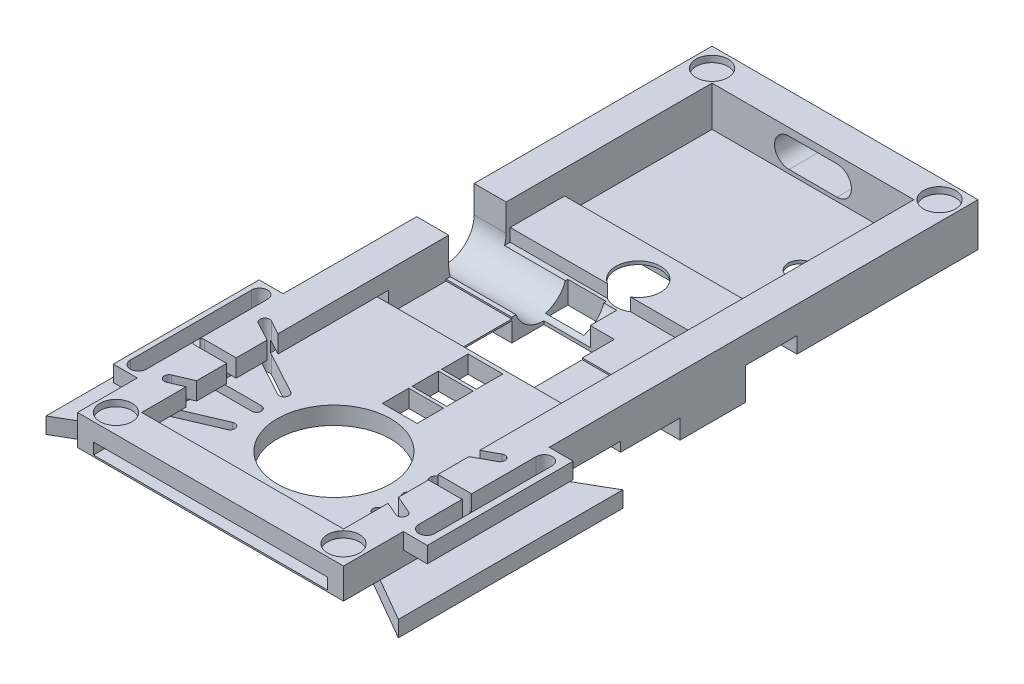
from build123d import *

# Parameters (mm, degrees)
SKETCH2_W            = 83
SKETCH2_H            = 198
BOSS_EXTRUDE5_DEPTH  = 2.5
SKETCH5_W            = 83
SKETCH5_H            = 198
SKETCH5_W_2          = 63
SKETCH5_H_2          = 178
BOSS_EXTRUDE6_DEPTH  = 12
SKETCH6_R            = 5
CUT_EXTRUDE1_DEPTH   = 2
CUT_EXTRUDE2_DEPTH   = 1
SKETCH11_W           = 83
SKETCH11_H           = 198
CUT_EXTRUDE4_DEPTH   = 3
BOSS_EXTRUDE9_DEPTH  = 1
SKETCH14_W           = 83
SKETCH14_H           = 56
BOSS_EXTRUDE10_DEPTH = 1
SKETCH16_W           = 83
SKETCH16_H           = 17
CUT_EXTRUDE6_DEPTH   = 4
SKETCH17_W           = 83
SKETCH17_H           = 17
BOSS_EXTRUDE13_DEPTH = 1
SKETCH19_W           = 83
SKETCH19_H           = 5
BOSS_EXTRUDE18_DEPTH = 0.5
SKETCH20_W           = 83
SKETCH20_H           = 20
BOSS_EXTRUDE22_DEPTH = 7
SKETCH22_W           = 83
SKETCH22_H           = 10
BOSS_EXTRUDE23_DEPTH = 0.5
SKETCH23_W           = 83
SKETCH23_H           = 105
CUT_EXTRUDE8_DEPTH   = 3
SKETCH26_W           = 10
SKETCH26_H           = 18
BOSS_EXTRUDE28_DEPTH = 3.5
SKETCH27_W           = 83
SKETCH27_H           = 18
BOSS_EXTRUDE29_DEPTH = 0.5
SKETCH28_W           = 83
SKETCH28_H           = 87
CUT_EXTRUDE9_DEPTH   = 3
SKETCH29_W           = 5
SKETCH29_H           = 87
BOSS_EXTRUDE34_DEPTH = 3.5
SKETCH30_W           = 5
SKETCH30_H           = 87
BOSS_EXTRUDE35_DEPTH = 3.5
SKETCH31_W           = 83
SKETCH31_H           = 87
BOSS_EXTRUDE36_DEPTH = 0.5
SKETCH32_W           = 83
SKETCH32_H           = 3
BOSS_EXTRUDE37_DEPTH = 0.5
SKETCH33_R           = 18.5
SKETCH33_W           = 12
SKETCH33_H           = 28
BOSS_EXTRUDE39_DEPTH = 5
SKETCH35_R           = 17.671278618
CUT_EXTRUDE11_DEPTH  = 25
SKETCH36_W           = 10.833147776
SKETCH36_H           = 8.25
CUT_EXTRUDE12_DEPTH  = 25
BOSS_EXTRUDE42_DEPTH = 5
SKETCH38_W           = 22
SKETCH38_H           = 28
CUT_EXTRUDE13_DEPTH  = 25
SKETCH39_R           = 7
SKETCH39_W           = 12
SKETCH39_H           = 7
CUT_EXTRUDE14_DEPTH  = 25
SKETCH15_R           = 3.75
CUT_EXTRUDE15_DEPTH  = 25
CUT_EXTRUDE17_DEPTH  = 45
SKETCH41_W           = 45.523641257
SKETCH41_H           = 5
BOSS_EXTRUDE44_DEPTH = 7.5
CUT_EXTRUDE18_DEPTH  = 7.5
SKETCH43_W           = 7.5
SKETCH43_H           = 45.523641257
BOSS_EXTRUDE46_DEPTH = 5
CUT_EXTRUDE19_DEPTH  = 5
CUT_EXTRUDE20_DEPTH  = 15
CUT_EXTRUDE23_DEPTH  = 15


with BuildPart() as part:
    # Sketch2 → Boss-Extrude5 (new body)
    with BuildSketch(Plane(origin=(0, 0, 0), x_dir=(1, 0, 0), z_dir=(0, 1, 0))):
        Rectangle(SKETCH2_W, SKETCH2_H)
    extrude(amount=BOSS_EXTRUDE5_DEPTH)

    # Sketch5 → Boss-Extrude6 (add)
    with BuildSketch(Plane(origin=(0, 2.5, 0), x_dir=(1, 0, 0), z_dir=(0, 1, 0))):
        Rectangle(SKETCH5_W, SKETCH5_H)
        Rectangle(SKETCH5_W_2, SKETCH5_H_2, mode=Mode.SUBTRACT)
    extrude(amount=BOSS_EXTRUDE6_DEPTH)

    # Sketch6 → Cut-Extrude1 (cut)
    with BuildSketch(Plane(origin=(0, 14.5, 0), x_dir=(1, 0, 0), z_dir=(0, 1, 0))):
        with Locations(Location((-35.5, -93, 0), (0, 0, 270))):
            Circle(SKETCH6_R)
        with Locations(Location((35.5, -93, 0), (0, 0, 270))):
            Circle(SKETCH6_R)
        with Locations(Location((35.5, 93, 0), (0, 0, 270))):
            Circle(SKETCH6_R)
        with Locations(Location((-35.5, 93, 0), (0, 0, 270))):
            Circle(SKETCH6_R)
    extrude(amount=-CUT_EXTRUDE1_DEPTH, mode=Mode.SUBTRACT)

    # Sketch9 → Cut-Extrude2 (cut)
    # profile 1 of 11: a face of its own
    with BuildSketch(Plane(origin=(0, 0, 0), x_dir=(-1, 0, 0), z_dir=(0, -1, 0))):
        with BuildLine():
            add(Edge.make_bspline(
                [(-18.430464524, 2.48626712), (-18.370713457, 2.484254645), (-18.251432903, 2.480237158), (-18.074778774, 2.448420071), (-17.900708157, 2.398998196), (-17.790193585, 2.349468415), (-17.734307429, 2.324421681)],
                knots=[0, 0, 0, 0, 0.994543132, 1.985398125, 2.981235217, 4, 4, 4, 4], degree=3))
            add(Edge.make_bspline(
                [(-17.734307429, 2.324421681), (-17.710362074, 2.312833845), (-17.666743069, 2.291725371), (-17.605174928, 2.269965166), (-17.556628328, 2.25250433), (-17.527226937, 2.250069294), (-17.514818409, 2.249041614)],
                knots=[0, 0, 0, 0, 1.366071158, 2.488443524, 3.362064513, 4, 4, 4, 4], degree=3))
            add(Edge.make_bspline(
                [(-17.514818409, 2.249041614), (-17.506182359, 2.249384789), (-17.48660693, 2.250162667), (-17.454154031, 2.255330255), (-17.414787938, 2.261492833), (-17.386677847, 2.268276185), (-17.371448477, 2.271951242)],
                knots=[0, 0, 0, 0, 0.712600479, 1.615259286, 2.708004946, 4, 4, 4, 4], degree=3))
            add(Edge.make_bspline(
                [(-17.371448477, 2.271951242), (-17.360155353, 2.274285058), (-17.336517268, 2.279170061), (-17.312372885, 2.279282647), (-17.299763511, 2.279341445)],
                knots=[0, 0, 0, 0, 0.955502454, 2, 2, 2, 2], degree=3))
            add(Edge.make_bspline(
                [(-17.299763511, 2.279341445), (-17.278857012, 2.277969033), (-17.237296794, 2.275240803), (-17.177607751, 2.251284594), (-17.122521693, 2.212561491), (-17.091905209, 2.17783931), (-17.075840369, 2.159620161)],
                knots=[0, 0, 0, 0, 0.951755322, 1.892002987, 2.893908443, 4, 4, 4, 4], degree=3))
            add(Edge.make_bspline(
                [(-17.075840369, 2.159620161), (-17.056885764, 2.135076295), (-17.019196409, 2.086273247), (-16.971052916, 2.006861849), (-16.929546807, 1.923728168), (-16.896090334, 1.835549279), (-16.870432769, 1.743231843), (-16.851905854, 1.646357819), (-16.840677207, 1.545267841), (-16.839309265, 1.476301555), (-16.838614862, 1.441292458)],
                knots=[0, 0, 0, 0, 0.963401013, 1.91562761, 2.881430175, 3.848567728, 4.842648035, 5.856443937, 6.911874666, 8, 8, 8, 8], degree=3))
            add(Edge.make_bspline(
                [(-16.838614862, 1.441292458), (-16.839083602, 1.416873782), (-16.839987224, 1.369800261), (-16.849713575, 1.301592622), (-16.86627313, 1.238913813), (-16.887036109, 1.180184163), (-16.916738514, 1.127565987), (-16.95110397, 1.078935165), (-16.993273195, 1.036387888), (-17.025035737, 1.012290001), (-17.041106416, 1.000097357)],
                knots=[0, 0, 0, 0, 1.157178249, 2.230770136, 3.256209274, 4.228107424, 5.174189859, 6.110999593, 7.044235235, 8, 8, 8, 8], degree=3))
            add(Edge.make_bspline(
                [(-17.041106416, 1.000097357), (-17.059515893, 0.988658529), (-17.096182637, 0.965875452), (-17.156901899, 0.942353933), (-17.22097423, 0.92775087), (-17.264950047, 0.926227219), (-17.287200166, 0.925456309)],
                knots=[0, 0, 0, 0, 0.994587699, 1.980952045, 2.978437263, 4, 4, 4, 4], degree=3))
            add(Edge.make_bspline(
                [(-17.287200166, 0.925456309), (-17.307189009, 0.926225318), (-17.345198707, 0.927687622), (-17.399637153, 0.937064929), (-17.448053002, 0.95413375), (-17.49196212, 0.978381695), (-17.531654536, 1.012646649), (-17.568685712, 1.057066972), (-17.607044263, 1.11050295), (-17.629331523, 1.151312686), (-17.641190875, 1.1730281)],
                knots=[0, 0, 0, 0, 1.041577197, 1.980606666, 2.865539255, 3.704510443, 4.578768394, 5.579698629, 6.712124829, 8, 8, 8, 8], degree=3))
            add(Edge.make_bspline(
                [(-17.641190875, 1.1730281), (-17.657763947, 1.20342941), (-17.68855454, 1.259911053), (-17.733880445, 1.336899032), (-17.773182875, 1.400843725), (-17.820643816, 1.467473978), (-17.884021187, 1.538821556), (-17.942906458, 1.584803314), (-17.973010977, 1.608311039)],
                knots=[0, 0, 0, 0, 1.127566679, 2.094870931, 2.909569875, 3.570805904, 4.758098266, 6, 6, 6, 6], degree=3))
            add(Edge.make_bspline(
                [(-17.973010977, 1.608311039), (-18.012198305, 1.634244957), (-18.08835995, 1.684648235), (-18.212638042, 1.737227231), (-18.339241078, 1.77099788), (-18.425330481, 1.774877696), (-18.468154558, 1.776807661)],
                knots=[0, 0, 0, 0, 1.05923958, 2.058661118, 3.034305701, 4, 4, 4, 4], degree=3))
            add(Edge.make_bspline(
                [(-18.468154558, 1.776807661), (-18.488626424, 1.776205743), (-18.528504759, 1.775033233), (-18.586775672, 1.76688212), (-18.641813271, 1.752797688), (-18.693813412, 1.732981445), (-18.742118199, 1.706602701), (-18.787712879, 1.675461836), (-18.829757951, 1.638371814), (-18.86837409, 1.595970248), (-18.902701648, 1.549090061), (-18.932737239, 1.498120587), (-18.957676947, 1.443291269), (-18.978563945, 1.384469809), (-18.994460714, 1.321834529), (-19.006611305, 1.255462568), (-19.013021505, 1.18522718), (-19.013860914, 1.137074026), (-19.014290538, 1.112428438)],
                knots=[0, 0, 0, 0, 1.013829975, 1.974898112, 2.907031647, 3.822406359, 4.723109209, 5.626699596, 6.551779913, 7.49313013, 8.461911618, 9.424450048, 10.418036234, 11.440637793, 12.511866762, 13.61513289, 14.779385202, 16, 16, 16, 16], degree=3))
            add(Edge.make_bspline(
                [(-19.014290538, 1.112428438), (-19.013888342, 1.077907239), (-19.013093538, 1.009687699), (-19.001724561, 0.90858428), (-18.986276946, 0.809357353), (-18.961949366, 0.712562897), (-18.932870959, 0.617751611), (-18.896025661, 0.525606972), (-18.853586261, 0.435202494), (-18.819877125, 0.377360185), (-18.80293074, 0.348281478)],
                knots=[0, 0, 0, 0, 1.031247379, 2.03791365, 3.037771106, 4.030691164, 5.018108569, 5.999826826, 6.99446533, 8, 8, 8, 8], degree=3))
            add(Edge.make_bspline(
                [(-18.80293074, 0.348281478), (-18.778725863, 0.311378149), (-18.731523859, 0.239412853), (-18.646727809, 0.145274109), (-18.555639251, 0.064103565), (-18.455484387, -0.001179552), (-18.348113163, -0.053049901), (-18.232572497, -0.089048104), (-18.109328934, -0.110956879), (-18.024589042, -0.113685289), (-17.9811402, -0.115084231)],
                knots=[0, 0, 0, 0, 1.069015146, 2.084689683, 3.062672767, 4.020500115, 4.974537104, 5.945799079, 6.946745732, 8, 8, 8, 8], degree=3))
            add(Edge.make_bspline(
                [(-17.9811402, -0.115084231), (-17.948337675, -0.114171307), (-17.882499351, -0.112338966), (-17.784368483, -0.099334538), (-17.686642614, -0.078695225), (-17.591416222, -0.049216707), (-17.501022688, -0.014243503), (-17.420257299, 0.02737449), (-17.349276115, 0.072525378), (-17.309889842, 0.108989885), (-17.290895267, 0.126575397)],
                knots=[0, 0, 0, 0, 1.052954964, 2.113398045, 3.172867416, 4.256157247, 5.310655612, 6.27984414, 7.170431038, 8, 8, 8, 8], degree=3))
            add(Edge.make_bspline(
                [(-17.290895267, 0.126575397), (-17.276388853, 0.139969021), (-17.249917562, 0.164409692), (-17.210152121, 0.193092737), (-17.174056177, 0.211224599), (-17.150620852, 0.214521645), (-17.140135132, 0.21599685)],
                knots=[0, 0, 0, 0, 1.325197549, 2.418219121, 3.292260257, 4, 4, 4, 4], degree=3))
            add(Edge.make_bspline(
                [(-17.140135132, 0.21599685), (-17.126221293, 0.214949864), (-17.098571679, 0.212869292), (-17.058617294, 0.197483287), (-17.023557742, 0.170183415), (-16.992090676, 0.134809622), (-16.96604861, 0.092461206), (-16.946298067, 0.045196735), (-16.93520315, -0.006676592), (-16.933887721, -0.042608465), (-16.933209456, -0.061135751)],
                knots=[0, 0, 0, 0, 0.872623042, 1.734078476, 2.640170075, 3.636614138, 4.692130371, 5.745946442, 6.837759026, 8, 8, 8, 8], degree=3))
            add(Edge.make_bspline(
                [(-16.933209456, -0.061135751), (-16.934254316, -0.086091153), (-16.936436669, -0.13821439), (-16.953739947, -0.218111767), (-16.981692657, -0.301993182), (-17.018620727, -0.387739815), (-17.062495354, -0.471029606), (-17.111853881, -0.546790292), (-17.166015844, -0.61297254), (-17.20669107, -0.650326601), (-17.226600504, -0.668610413)],
                knots=[0, 0, 0, 0, 0.865314323, 1.807343493, 2.823606105, 3.930165877, 5.042782542, 6.085827563, 7.063063862, 8, 8, 8, 8], degree=3))
            add(Edge.make_bspline(
                [(-17.226600504, -0.668610413), (-17.237218309, -0.675919418), (-17.261711441, -0.692779815), (-17.309703633, -0.71040463), (-17.370231829, -0.729154238), (-17.415918204, -0.738743521), (-17.440916382, -0.743990481)],
                knots=[0, 0, 0, 0, 0.67377611, 1.554265273, 2.661769213, 4, 4, 4, 4], degree=3))
            add(Edge.make_bspline(
                [(-17.440916382, -0.743990481), (-17.457766121, -0.747578593), (-17.494753085, -0.755454878), (-17.552578866, -0.776567627), (-17.618811299, -0.803029525), (-17.664710815, -0.824760706), (-17.689227193, -0.836368015)],
                knots=[0, 0, 0, 0, 0.777438296, 1.706559577, 2.775001235, 4, 4, 4, 4], degree=3))
            add(Edge.make_bspline(
                [(-17.689227193, -0.836368015), (-17.719638191, -0.850468715), (-17.780058337, -0.878483791), (-17.872698274, -0.914923126), (-17.966646193, -0.944909806), (-18.061239192, -0.970418479), (-18.156846108, -0.989359651), (-18.252991897, -1.003679743), (-18.350262111, -1.011848014), (-18.415423404, -1.013102064), (-18.448201011, -1.01373288)],
                knots=[0, 0, 0, 0, 1.023278553, 2.03303558, 3.036724571, 4.032776533, 5.02247644, 6.010574797, 6.999274039, 8, 8, 8, 8], degree=3))
            add(Edge.make_bspline(
                [(-18.448201011, -1.01373288), (-18.516833816, -1.011395559), (-18.654958379, -1.006691666), (-18.861247704, -0.970072329), (-19.067646681, -0.913045672), (-19.200807173, -0.857314631), (-19.268513511, -0.828977812)],
                knots=[0, 0, 0, 0, 0.97206299, 1.956291528, 2.960862834, 4, 4, 4, 4], degree=3))
            add(Edge.make_bspline(
                [(-19.268513511, -0.828977812), (-19.307511435, -0.810630131), (-19.384796166, -0.774269336), (-19.494397315, -0.709133664), (-19.598216484, -0.637695247), (-19.695093104, -0.55806689), (-19.786499462, -0.472159047), (-19.8715721, -0.37885992), (-19.950277435, -0.278360883), (-19.996733553, -0.206600347), (-20.020097125, -0.170510751)],
                knots=[0, 0, 0, 0, 1.01921468, 2.019844185, 3.012565876, 3.998436806, 4.983876906, 5.978171524, 6.983188029, 8, 8, 8, 8], degree=3))
            add(Edge.make_bspline(
                [(-20.020097125, -0.170510751), (-20.041731575, -0.134553141), (-20.084442823, -0.063564767), (-20.140027222, 0.046186995), (-20.186870255, 0.157266366), (-20.224399957, 0.269806164), (-20.254208185, 0.383340943), (-20.275800536, 0.498129128), (-20.288552798, 0.614285752), (-20.290395594, 0.692141793), (-20.291317565, 0.731093978)],
                knots=[0, 0, 0, 0, 1.055267813, 2.083334945, 3.091415004, 4.084839949, 5.064723394, 6.041801365, 7.020292887, 8, 8, 8, 8], degree=3))
            add(Edge.make_bspline(
                [(-20.291317565, 0.731093978), (-20.290406571, 0.776225756), (-20.288598446, 0.865802493), (-20.271563904, 0.998501054), (-20.245050132, 1.128241767), (-20.208142956, 1.255215306), (-20.15963973, 1.378847035), (-20.101344203, 1.499712587), (-20.031389005, 1.617108757), (-19.977792025, 1.691705126), (-19.95062922, 1.729510364)],
                knots=[0, 0, 0, 0, 1.008024733, 2.000709278, 2.984133389, 3.964780855, 4.951173464, 5.948197717, 6.960152152, 8, 8, 8, 8], degree=3))
            add(Edge.make_bspline(
                [(-19.95062922, 1.729510364), (-19.925510593, 1.761712874), (-19.8755091, 1.825815644), (-19.791717052, 1.914251017), (-19.70370817, 1.99823275), (-19.610105102, 2.076542009), (-19.510293748, 2.14842748), (-19.4053199, 2.215068572), (-19.294489917, 2.27586087), (-19.21726075, 2.311101653), (-19.178353038, 2.328855803)],
                knots=[0, 0, 0, 0, 0.991161157, 1.973019346, 2.954622418, 3.944121643, 4.933620867, 5.939242354, 6.961799438, 8, 8, 8, 8], degree=3))
            add(Edge.make_bspline(
                [(-19.178353038, 2.328855803), (-19.117954707, 2.353084038), (-18.997884246, 2.401249198), (-18.811062293, 2.449723447), (-18.621703517, 2.481046104), (-18.494391279, 2.484521856), (-18.430464524, 2.48626712)],
                knots=[0, 0, 0, 0, 1.01399719, 2.015802553, 3.003683334, 4, 4, 4, 4], degree=3))
        make_face()
    # profile 2 of 11: a face of its own
    with BuildSketch(Plane(origin=(0, 0, 0), x_dir=(-1, 0, 0), z_dir=(0, -1, 0))):
        with BuildLine():
            add(Edge.make_bspline(
                [(-14.708019423, 2.48626712), (-14.655503598, 2.485098258), (-14.551673376, 2.482787275), (-14.398715845, 2.465441266), (-14.250722189, 2.437310543), (-14.107702657, 2.398292554), (-13.969602642, 2.347264149), (-13.837262048, 2.283516502), (-13.708381269, 2.211333013), (-13.628515764, 2.153295991), (-13.588403713, 2.124147188)],
                knots=[0, 0, 0, 0, 1.051844963, 2.079626439, 3.079387353, 4.067054608, 5.046041816, 6.023896578, 7.007511949, 8, 8, 8, 8], degree=3))
            add(Edge.make_bspline(
                [(-13.588403713, 2.124147188), (-13.56176406, 2.103050735), (-13.508329719, 2.060735056), (-13.433213531, 1.991141196), (-13.36217307, 1.916668203), (-13.293967204, 1.838729433), (-13.230328625, 1.755183531), (-13.169730466, 1.667651433), (-13.11341533, 1.574998696), (-13.079390148, 1.510692118), (-13.062221281, 1.478243472)],
                knots=[0, 0, 0, 0, 0.970644245, 1.946937291, 2.922621233, 3.910516206, 4.904410596, 5.921583779, 6.951245804, 8, 8, 8, 8], degree=3))
            add(Edge.make_bspline(
                [(-13.062221281, 1.478243472), (-13.046566706, 1.445650153), (-13.015499705, 1.380967675), (-12.976104918, 1.282049313), (-12.941631593, 1.183287248), (-12.91363655, 1.084611585), (-12.891840452, 0.985925326), (-12.877582427, 0.887081081), (-12.867130707, 0.788467071), (-12.866136219, 0.722499369), (-12.865641889, 0.689708843)],
                knots=[0, 0, 0, 0, 1.058036634, 2.099707382, 3.114403172, 4.118670422, 5.100161022, 6.069901926, 7.04060732, 8, 8, 8, 8], degree=3))
            add(Edge.make_bspline(
                [(-12.865641889, 0.689708843), (-12.866685607, 0.641855152), (-12.868754129, 0.547014963), (-12.888110517, 0.406832699), (-12.918128548, 0.27051083), (-12.960679365, 0.137911024), (-13.015252643, 0.009082321), (-13.083317169, -0.115363339), (-13.162240244, -0.23658529), (-13.223387009, -0.312413775), (-13.254366551, -0.350831697)],
                knots=[0, 0, 0, 0, 1.011547597, 2.004764173, 2.986864892, 3.960583769, 4.945650878, 5.941037557, 6.956842404, 8, 8, 8, 8], degree=3))
            add(Edge.make_bspline(
                [(-13.254366551, -0.350831697), (-13.282497531, -0.382536898), (-13.338623668, -0.445794218), (-13.430589358, -0.532980728), (-13.528896333, -0.613144895), (-13.632981171, -0.687289309), (-13.744177172, -0.754017794), (-13.862257423, -0.812578932), (-13.985420196, -0.866651614), (-14.071235185, -0.895630729), (-14.114586146, -0.910270042)],
                knots=[0, 0, 0, 0, 0.977965172, 1.951208449, 2.920924385, 3.903769687, 4.898369367, 5.910384584, 6.944393771, 8, 8, 8, 8], degree=3))
            add(Edge.make_bspline(
                [(-14.114586146, -0.910270042), (-14.168813108, -0.926146374), (-14.276570302, -0.957695053), (-14.440977587, -0.98971982), (-14.605537933, -1.009696807), (-14.715353703, -1.012390211), (-14.770097125, -1.01373288)],
                knots=[0, 0, 0, 0, 1.017501807, 2.021930326, 3.013927564, 4, 4, 4, 4], degree=3))
            add(Edge.make_bspline(
                [(-14.770097125, -1.01373288), (-14.805829769, -1.013102345), (-14.876892859, -1.011848373), (-14.983010996, -1.003670674), (-15.087789594, -0.989442837), (-15.191733428, -0.970405731), (-15.294261883, -0.945073449), (-15.395972564, -0.91478212), (-15.496378496, -0.87870342), (-15.561971227, -0.850501645), (-15.594843747, -0.836368015)],
                knots=[0, 0, 0, 0, 1.009055621, 2.006753535, 3.003359543, 3.993901918, 4.989341907, 5.984125409, 6.989722224, 8, 8, 8, 8], degree=3))
            add(Edge.make_bspline(
                [(-15.594843747, -0.836368015), (-15.633848616, -0.81803209), (-15.711147109, -0.781694591), (-15.820232028, -0.716634436), (-15.923799365, -0.646320713), (-16.020862004, -0.568945739), (-16.110120128, -0.483226773), (-16.194219442, -0.392016808), (-16.272222978, -0.294110537), (-16.317688962, -0.223631367), (-16.3405152, -0.188247238)],
                knots=[0, 0, 0, 0, 1.030857394, 2.04291731, 3.035438857, 4.025155278, 5.009237461, 5.993884518, 6.992827961, 8, 8, 8, 8], degree=3))
            add(Edge.make_bspline(
                [(-16.3405152, -0.188247238), (-16.361471616, -0.153055212), (-16.403066456, -0.083205161), (-16.456188726, 0.026086744), (-16.501587467, 0.137552197), (-16.537600467, 0.252154911), (-16.56668047, 0.369068612), (-16.587499863, 0.489062416), (-16.599207966, 0.611877728), (-16.6011504, 0.694612089), (-16.602128375, 0.73626712)],
                knots=[0, 0, 0, 0, 1.009325406, 2.00333536, 2.992305541, 3.973695717, 4.961975817, 5.960335459, 6.973071281, 8, 8, 8, 8], degree=3))
            add(Edge.make_bspline(
                [(-16.602128375, 0.73626712), (-16.601155595, 0.784590382), (-16.599239605, 0.879767958), (-16.583401054, 1.020438998), (-16.556760933, 1.156565029), (-16.519795694, 1.288584495), (-16.472172002, 1.416311734), (-16.414574202, 1.539735212), (-16.346425207, 1.659172623), (-16.29290539, 1.733894675), (-16.265874152, 1.771634519)],
                knots=[0, 0, 0, 0, 1.046408287, 2.061007504, 3.06133757, 4.047798165, 5.026959698, 6.010371128, 6.995098758, 8, 8, 8, 8], degree=3))
            add(Edge.make_bspline(
                [(-16.265874152, 1.771634519), (-16.24027604, 1.804340754), (-16.189424685, 1.869312592), (-16.104080861, 1.958970448), (-16.013228278, 2.04272397), (-15.915593152, 2.119885381), (-15.810733373, 2.189079052), (-15.700434938, 2.253008225), (-15.583441744, 2.310279031), (-15.501723323, 2.342234655), (-15.460342058, 2.358416614)],
                knots=[0, 0, 0, 0, 0.985888601, 1.958494869, 2.935682924, 3.91884238, 4.910270308, 5.916774205, 6.945078517, 8, 8, 8, 8], degree=3))
            add(Edge.make_bspline(
                [(-15.460342058, 2.358416614), (-15.402555196, 2.378353015), (-15.285612061, 2.418698262), (-15.10083911, 2.457445156), (-14.907471141, 2.481677249), (-14.775346673, 2.484717756), (-14.708019423, 2.48626712)],
                knots=[0, 0, 0, 0, 0.955506866, 1.933656958, 2.94704443, 4, 4, 4, 4], degree=3))
        make_face()
        with BuildLine():
            add(Edge.make_bspline(
                [(-14.920857261, 1.776807661), (-14.936920263, 1.776284843), (-14.968559776, 1.775255043), (-15.014609352, 1.765742461), (-15.058785608, 1.752291455), (-15.099467274, 1.730986084), (-15.137785043, 1.704808336), (-15.17337703, 1.672826095), (-15.206168874, 1.63466008), (-15.225146181, 1.606069786), (-15.234940875, 1.591313573)],
                knots=[0, 0, 0, 0, 1.006775924, 1.983060122, 2.941306894, 3.895429469, 4.851678852, 5.847954811, 6.889272089, 8, 8, 8, 8], degree=3))
            add(Edge.make_bspline(
                [(-15.234940875, 1.591313573), (-15.248817064, 1.567563279), (-15.276835188, 1.519607845), (-15.304277292, 1.439146144), (-15.321855468, 1.352639784), (-15.323998858, 1.292595422), (-15.325101348, 1.261710532)],
                knots=[0, 0, 0, 0, 0.951288008, 1.920794309, 2.930523426, 4, 4, 4, 4], degree=3))
            add(Edge.make_bspline(
                [(-15.325101348, 1.261710532), (-15.323767006, 1.213115541), (-15.320985762, 1.111826248), (-15.298683612, 0.955047354), (-15.26434009, 0.787323827), (-15.217691504, 0.61221419), (-15.161267109, 0.43646415), (-15.096412754, 0.267816163), (-15.024105499, 0.109543895), (-14.969258286, 0.00998828), (-14.942288848, -0.038965143)],
                knots=[0, 0, 0, 0, 0.851887102, 1.775636513, 2.771927568, 3.853257604, 4.951607259, 6.007335301, 7.020168178, 8, 8, 8, 8], degree=3))
            add(Edge.make_bspline(
                [(-14.942288848, -0.038965143), (-14.929593386, -0.058433245), (-14.904659668, -0.096668336), (-14.861659189, -0.148820758), (-14.813827131, -0.194194278), (-14.762747689, -0.233277376), (-14.708677419, -0.264229788), (-14.654079515, -0.287662062), (-14.598354826, -0.301655847), (-14.561028745, -0.30340443), (-14.542478882, -0.30427342)],
                knots=[0, 0, 0, 0, 1.113912043, 2.187708353, 3.232060128, 4.269172407, 5.263986051, 6.211680872, 7.111262858, 8, 8, 8, 8], degree=3))
            add(Edge.make_bspline(
                [(-14.542478882, -0.30427342), (-14.51366307, -0.302725429), (-14.457653493, -0.299716582), (-14.378676073, -0.271602704), (-14.308330303, -0.226909076), (-14.249710187, -0.163599509), (-14.20159705, -0.087155036), (-14.166649655, 0.001738825), (-14.14594377, 0.101730085), (-14.143789192, 0.172045837), (-14.142668916, 0.208606647)],
                knots=[0, 0, 0, 0, 0.946251944, 1.839239202, 2.726048847, 3.66727789, 4.655527083, 5.686138377, 6.796903217, 8, 8, 8, 8], degree=3))
            add(Edge.make_bspline(
                [(-14.142668916, 0.208606647), (-14.143923333, 0.259640512), (-14.146487102, 0.363943237), (-14.164170736, 0.522978371), (-14.193314406, 0.687795529), (-14.233499396, 0.855222755), (-14.281958893, 1.019656636), (-14.337676621, 1.174498338), (-14.401153257, 1.31649011), (-14.449982624, 1.404410129), (-14.473749997, 1.44720462)],
                knots=[0, 0, 0, 0, 0.945659483, 1.932733523, 2.961681864, 4.04567364, 5.121744827, 6.13695095, 7.093173116, 8, 8, 8, 8], degree=3))
            add(Edge.make_bspline(
                [(-14.473749997, 1.44720462), (-14.4888071, 1.471416849), (-14.518136638, 1.518579537), (-14.568798235, 1.582362802), (-14.62280993, 1.638351724), (-14.680343063, 1.685326625), (-14.739176701, 1.724348219), (-14.799416957, 1.75258561), (-14.859920351, 1.771447436), (-14.900779955, 1.77504159), (-14.920857261, 1.776807661)],
                knots=[0, 0, 0, 0, 1.183501978, 2.305328301, 3.376255037, 4.408653338, 5.384967338, 6.300458299, 7.164891106, 8, 8, 8, 8], degree=3))
        make_face(mode=Mode.SUBTRACT)
    # profile 3 of 11: a face of its own
    with BuildSketch(Plane(origin=(0, 0, 0), x_dir=(-1, 0, 0), z_dir=(0, -1, 0))):
        with BuildLine():
            Line((-10.452740706, 1.551406478), (-10.525164693, 1.725076242))
            add(Edge.make_bspline(
                [(-10.525164693, 1.725076242), (-10.536338, 1.754823038), (-10.556892006, 1.809544154), (-10.598095998, 1.879456796), (-10.642353295, 1.933607217), (-10.67894574, 1.955245173), (-10.695878375, 1.96525783)],
                knots=[0, 0, 0, 0, 1.26120691, 2.320069966, 3.222636208, 4, 4, 4, 4], degree=3))
            add(Edge.make_bspline(
                [(-10.695878375, 1.96525783), (-10.710330399, 1.972608245), (-10.737947468, 1.986654507), (-10.775154473, 2.011415087), (-10.807288295, 2.036978621), (-10.833201075, 2.064461352), (-10.854178203, 2.092935624), (-10.867803624, 2.123552737), (-10.877643054, 2.155324956), (-10.878645657, 2.177279681), (-10.879155402, 2.188441951)],
                knots=[0, 0, 0, 0, 1.274788197, 2.436054187, 3.510778093, 4.498034506, 5.401631632, 6.277568582, 7.124277557, 8, 8, 8, 8], degree=3))
            add(Edge.make_bspline(
                [(-10.879155402, 2.188441951), (-10.878490908, 2.20060738), (-10.877186477, 2.224488645), (-10.865239048, 2.259116192), (-10.845827348, 2.291090817), (-10.818073884, 2.320185919), (-10.784016179, 2.347634472), (-10.741899491, 2.372165031), (-10.692052944, 2.392764116), (-10.635502498, 2.413131507), (-10.571273869, 2.430679048), (-10.499042131, 2.444927693), (-10.419778889, 2.458504711), (-10.332667842, 2.468500813), (-10.238276275, 2.476505299), (-10.136264934, 2.482583326), (-10.026583895, 2.48506329), (-9.950946324, 2.485856409), (-9.911777869, 2.48626712)],
                knots=[0, 0, 0, 0, 0.536799426, 1.053760572, 1.601403313, 2.179845644, 2.823226354, 3.531628717, 4.327293706, 5.20629658, 6.18988224, 7.269273785, 8.462547327, 9.746767792, 11.146917289, 12.653435066, 14.267001753, 16, 16, 16, 16], degree=3))
            add(Edge.make_bspline(
                [(-9.911777869, 2.48626712), (-9.872611544, 2.485826316), (-9.796978087, 2.484975086), (-9.687007451, 2.482894115), (-9.584345012, 2.475358274), (-9.4885828, 2.468235978), (-9.400257525, 2.456351346), (-9.318840944, 2.444851108), (-9.245027118, 2.428241422), (-9.198578702, 2.415485417), (-9.1764527, 2.409409012)],
                knots=[0, 0, 0, 0, 1.267529621, 2.447705987, 3.558030398, 4.597996478, 5.554081833, 6.441329293, 7.257517179, 8, 8, 8, 8], degree=3))
            add(Edge.make_bspline(
                [(-9.1764527, 2.409409012), (-9.162751751, 2.404598452), (-9.135826571, 2.395144714), (-9.099008543, 2.375164112), (-9.066384097, 2.351030871), (-9.038786489, 2.32316367), (-9.015546848, 2.293163806), (-8.998816678, 2.260689755), (-8.988862549, 2.226474292), (-8.987794154, 2.203038152), (-8.987263511, 2.191398032)],
                knots=[0, 0, 0, 0, 1.127531642, 2.215831273, 3.24238639, 4.271617853, 5.256038844, 6.181102948, 7.096601288, 8, 8, 8, 8], degree=3))
            add(Edge.make_bspline(
                [(-8.987263511, 2.191398032), (-8.988072799, 2.172999722), (-8.989520268, 2.140093074), (-9.005408671, 2.100625348), (-9.02901684, 2.073556202), (-9.055978774, 2.046298781), (-9.092973059, 2.011087078), (-9.121000717, 1.984935394), (-9.136545605, 1.970430972)],
                knots=[0, 0, 0, 0, 1.190259691, 2.12886165, 2.685812979, 3.511347902, 4.61972704, 6, 6, 6, 6], degree=3))
            add(Edge.make_bspline(
                [(-9.136545605, 1.970430972), (-9.145444085, 1.962069517), (-9.162325933, 1.946206491), (-9.182129264, 1.919591174), (-9.194159875, 1.891319634), (-9.195667716, 1.871997745), (-9.196406247, 1.862534012)],
                knots=[0, 0, 0, 0, 1.150053324, 2.181836378, 3.10947558, 4, 4, 4, 4], degree=3))
            add(Edge.make_bspline(
                [(-9.196406247, 1.862534012), (-9.195235443, 1.845685983), (-9.192523382, 1.80665905), (-9.172543985, 1.742255619), (-9.146931339, 1.662079764), (-9.122562198, 1.604916665), (-9.109201855, 1.573577087)],
                knots=[0, 0, 0, 0, 0.666352318, 1.543544816, 2.653252321, 4, 4, 4, 4], degree=3))
            Line((-9.109201855, 1.573577087), (-8.978395267, 1.266144654))
            add(Edge.make_bspline(
                [(-8.978395267, 1.266144654), (-8.963510966, 1.234793497), (-8.936531372, 1.177965735), (-8.898496861, 1.10268696), (-8.867272498, 1.046385185), (-8.843553829, 1.005608557), (-8.820257712, 0.97879095), (-8.797395177, 0.960563873), (-8.772444635, 0.949076709), (-8.755078635, 0.947620449), (-8.746342902, 0.946887897)],
                knots=[0, 0, 0, 0, 2.027772553, 3.675582807, 4.925337159, 5.791885889, 6.424177819, 6.988433472, 7.491145064, 8, 8, 8, 8], degree=3))
            add(Edge.make_bspline(
                [(-8.746342902, 0.946887897), (-8.736799274, 0.947424133), (-8.717790297, 0.948492206), (-8.691723028, 0.962962964), (-8.667520534, 0.983219536), (-8.645190659, 1.01378602), (-8.623318384, 1.055981782), (-8.598084953, 1.111969193), (-8.570458453, 1.183663548), (-8.551813222, 1.237017365), (-8.541634288, 1.266144654)],
                knots=[0, 0, 0, 0, 0.567355855, 1.130057995, 1.749835203, 2.457435075, 3.384829485, 4.603795269, 6.145920152, 8, 8, 8, 8], degree=3))
            Line((-8.541634288, 1.266144654), (-8.421913004, 1.613484181))
            add(Edge.make_bspline(
                [(-8.421913004, 1.613484181), (-8.414546723, 1.635590505), (-8.400962812, 1.676356036), (-8.385282904, 1.733756904), (-8.374569483, 1.782079046), (-8.373063403, 1.811748438), (-8.372398646, 1.824843978)],
                knots=[0, 0, 0, 0, 1.283049029, 2.366027745, 3.278793834, 4, 4, 4, 4], degree=3))
            add(Edge.make_bspline(
                [(-8.372398646, 1.824843978), (-8.373585795, 1.839373976), (-8.375904517, 1.867753759), (-8.397274161, 1.906547072), (-8.434338166, 1.934672931), (-8.464142232, 1.945880905), (-8.480295605, 1.951955465)],
                knots=[0, 0, 0, 0, 0.964050136, 1.882969018, 2.852599809, 4, 4, 4, 4], degree=3))
            add(Edge.make_bspline(
                [(-8.480295605, 1.951955465), (-8.497940089, 1.957974944), (-8.531447849, 1.969406237), (-8.577184226, 1.991817069), (-8.616283088, 2.017372112), (-8.647522098, 2.047749168), (-8.673523722, 2.079907639), (-8.690655608, 2.116738424), (-8.701399033, 2.156545922), (-8.702772403, 2.184428128), (-8.703479727, 2.198788235)],
                knots=[0, 0, 0, 0, 1.244276815, 2.362943996, 3.394455147, 4.348922122, 5.26398862, 6.139891995, 7.041992967, 8, 8, 8, 8], degree=3))
            add(Edge.make_bspline(
                [(-8.703479727, 2.198788235), (-8.70320054, 2.211158593), (-8.702652308, 2.235449875), (-8.69408181, 2.270029555), (-8.681322606, 2.302386917), (-8.662923592, 2.331590462), (-8.639254487, 2.358044743), (-8.6109888, 2.381832216), (-8.577308181, 2.402526823), (-8.538237132, 2.420279644), (-8.493324871, 2.435531958), (-8.442174551, 2.450008145), (-8.383885706, 2.46016266), (-8.319398529, 2.470127581), (-8.248353594, 2.477322825), (-8.170692067, 2.482112655), (-8.086441559, 2.486320543), (-8.028021242, 2.486285368), (-7.997715369, 2.48626712)],
                knots=[0, 0, 0, 0, 0.703062421, 1.380581478, 2.016553528, 2.678630622, 3.33487959, 4.032173918, 4.776082253, 5.57994236, 6.472195284, 7.47672628, 8.605381787, 9.84007175, 11.194819052, 12.671871152, 14.273514168, 16, 16, 16, 16], degree=3))
            add(Edge.make_bspline(
                [(-7.997715369, 2.48626712), (-7.959021047, 2.485486843), (-7.886181888, 2.48401803), (-7.783481514, 2.475156336), (-7.694393399, 2.458169958), (-7.641107056, 2.440007458), (-7.616380909, 2.43157962)],
                knots=[0, 0, 0, 0, 1.19904627, 2.257114694, 3.19125923, 4, 4, 4, 4], degree=3))
            add(Edge.make_bspline(
                [(-7.616380909, 2.43157962), (-7.60142305, 2.425291032), (-7.572702206, 2.413216205), (-7.533869422, 2.389872338), (-7.500549904, 2.364391912), (-7.472929409, 2.335744986), (-7.452294073, 2.303704848), (-7.437288194, 2.269281271), (-7.427945204, 2.232040575), (-7.426961797, 2.206235185), (-7.4264527, 2.192876073)],
                knots=[0, 0, 0, 0, 1.191518317, 2.287854934, 3.320256395, 4.268199367, 5.197448918, 6.1058178, 7.019406719, 8, 8, 8, 8], degree=3))
            add(Edge.make_bspline(
                [(-7.4264527, 2.192876073), (-7.42768575, 2.170153886), (-7.430068856, 2.126238926), (-7.454043528, 2.074954976), (-7.48275512, 2.037092315), (-7.512257072, 2.004046778), (-7.551185382, 1.967214421), (-7.580543399, 1.94196685), (-7.596427362, 1.928306816)],
                knots=[0, 0, 0, 0, 1.245005409, 2.406210364, 3.047327659, 3.8651028, 4.844927862, 6, 6, 6, 6], degree=3))
            add(Edge.make_bspline(
                [(-7.596427362, 1.928306816), (-7.617188612, 1.909603613), (-7.657040856, 1.873701892), (-7.696752165, 1.816843081), (-7.724212168, 1.761452692), (-7.749031782, 1.70325864), (-7.779102113, 1.628359574), (-7.800036449, 1.572396775), (-7.811482261, 1.541799215)],
                knots=[0, 0, 0, 0, 1.119269065, 2.148492204, 2.759013863, 3.600728486, 4.688202571, 6, 6, 6, 6], degree=3))
            Line((-7.811482261, 1.541799215), (-8.228289693, 0.381537391))
            add(Edge.make_bspline(
                [(-8.228289693, 0.381537391), (-8.241116103, 0.348534285), (-8.266089755, 0.284275615), (-8.302171318, 0.190615995), (-8.336278394, 0.102127691), (-8.368879997, 0.01899341), (-8.398912109, -0.059543252), (-8.428012918, -0.13250055), (-8.454324586, -0.200703431), (-8.479724038, -0.263314142), (-8.502372311, -0.321161491), (-8.523959376, -0.37347022), (-8.543239013, -0.420740302), (-8.559943504, -0.463086829), (-8.575956835, -0.499977023), (-8.588608167, -0.532380589), (-8.600766182, -0.558985715), (-8.629638573, -0.623926908), (-8.678198522, -0.72331275), (-8.730291484, -0.811783048), (-8.755211146, -0.854104501)],
                knots=[0, 0, 0, 0, 1.421642673, 2.768008259, 4.029872038, 5.229254812, 6.353357853, 7.405772461, 8.382897633, 9.288365855, 10.118533477, 10.877089748, 11.56033325, 12.168267021, 12.704647304, 13.174843934, 13.564490767, 13.878820873, 16.02855541, 18, 18, 18, 18], degree=3))
            add(Edge.make_bspline(
                [(-8.755211146, -0.854104501), (-8.764870291, -0.867782462), (-8.783387884, -0.894004544), (-8.813282054, -0.92988179), (-8.847192749, -0.956767137), (-8.881839013, -0.979565745), (-8.921090237, -0.995142962), (-8.965072114, -1.006041634), (-9.014904109, -1.01263284), (-9.050059239, -1.013353639), (-9.06855574, -1.01373288)],
                knots=[0, 0, 0, 0, 1.084416369, 2.078939747, 3.007897823, 3.874991178, 4.75445869, 5.725176289, 6.803125492, 8, 8, 8, 8], degree=3))
            add(Edge.make_bspline(
                [(-9.06855574, -1.01373288), (-9.09323612, -1.012839899), (-9.140194106, -1.011140873), (-9.207305719, -0.999507075), (-9.266829428, -0.978982162), (-9.319692791, -0.949492735), (-9.365742282, -0.909543254), (-9.407336728, -0.859657106), (-9.445962942, -0.799737584), (-9.466495015, -0.754400744), (-9.47723395, -0.730688116)],
                knots=[0, 0, 0, 0, 1.108272326, 2.10864809, 3.046316585, 3.923146037, 4.809899164, 5.767457071, 6.832308148, 8, 8, 8, 8], degree=3))
            Line((-9.47723395, -0.730688116), (-9.973855571, 0.436963911))
            add(Edge.make_bspline(
                [(-9.973855571, 0.436963911), (-9.979889666, 0.451797433), (-9.990741207, 0.478473611), (-10.006908045, 0.513547148), (-10.020973602, 0.539369851), (-10.034691755, 0.562217607), (-10.056744869, 0.581631975), (-10.07813311, 0.583214393), (-10.089142734, 0.584028945)],
                knots=[0, 0, 0, 0, 1.449023839, 2.605882629, 3.493679818, 4.105815713, 5.024966227, 6, 6, 6, 6], degree=3))
            add(Edge.make_bspline(
                [(-10.089142734, 0.584028945), (-10.097653356, 0.583349638), (-10.115024134, 0.581963125), (-10.139566085, 0.568989721), (-10.161038799, 0.547990329), (-10.177561268, 0.525089238), (-10.190888642, 0.500778786), (-10.203008569, 0.475913606), (-10.218177967, 0.445304949), (-10.235008815, 0.40826657), (-10.254074293, 0.365195109), (-10.274718376, 0.315694495), (-10.298573745, 0.260808221), (-10.314389019, 0.221701002), (-10.322673139, 0.201216445)],
                knots=[0, 0, 0, 0, 0.654278619, 1.335428623, 2.089804176, 2.961852438, 3.507370781, 4.231092661, 5.099600653, 6.14742242, 7.3749402, 8.739898359, 10.292342368, 12, 12, 12, 12], degree=3))
            Line((-10.322673139, 0.201216445), (-10.664839524, -0.636093522))
            add(Edge.make_bspline(
                [(-10.664839524, -0.636093522), (-10.679892027, -0.671287845), (-10.707643741, -0.736174249), (-10.752435809, -0.822559155), (-10.79593462, -0.890154493), (-10.841323388, -0.94039353), (-10.892957617, -0.97541611), (-10.953540991, -0.997572208), (-11.024317269, -1.011947567), (-11.075159119, -1.013110935), (-11.102339524, -1.01373288)],
                knots=[0, 0, 0, 0, 1.459965891, 2.691682254, 3.708235155, 4.519411335, 5.257082246, 6.063398588, 6.964679444, 8, 8, 8, 8], degree=3))
            add(Edge.make_bspline(
                [(-11.102339524, -1.01373288), (-11.127045557, -1.013028146), (-11.174195075, -1.011683216), (-11.241002622, -0.997569906), (-11.299643819, -0.973831797), (-11.351455095, -0.940067136), (-11.39722419, -0.893625478), (-11.437543129, -0.832980324), (-11.479131304, -0.760515418), (-11.501369433, -0.705405191), (-11.513234794, -0.676000616)],
                knots=[0, 0, 0, 0, 1.028693485, 1.96318051, 2.828904341, 3.651984682, 4.523293102, 5.526034128, 6.679992506, 8, 8, 8, 8], degree=3))
            Line((-11.513234794, -0.676000616), (-12.43183699, 1.657825397))
            add(Edge.make_bspline(
                [(-12.43183699, 1.657825397), (-12.440468997, 1.682787482), (-12.455678757, 1.726771154), (-12.478412904, 1.783211017), (-12.494390296, 1.822733881), (-12.509079938, 1.849365944), (-12.530032714, 1.866685624), (-12.557530176, 1.885857315), (-12.59691001, 1.908259788), (-12.627128952, 1.92399146), (-12.643935808, 1.932740938)],
                knots=[0, 0, 0, 0, 1.735951012, 3.058778965, 3.994159582, 4.546756123, 5.028117601, 5.760253759, 6.754321258, 8, 8, 8, 8], degree=3))
            add(Edge.make_bspline(
                [(-12.643935808, 1.932740938), (-12.663265509, 1.943974752), (-12.700716662, 1.965740184), (-12.742131421, 2.016280263), (-12.767009821, 2.077688442), (-12.769655355, 2.122173235), (-12.771047294, 2.145578776)],
                knots=[0, 0, 0, 0, 1.017024474, 1.970477356, 2.932172733, 4, 4, 4, 4], degree=3))
            add(Edge.make_bspline(
                [(-12.771047294, 2.145578776), (-12.770336947, 2.159451052), (-12.76894621, 2.186610559), (-12.757928257, 2.225801019), (-12.741138849, 2.262942135), (-12.71515801, 2.295916666), (-12.683518251, 2.32693928), (-12.644808701, 2.354826651), (-12.599012505, 2.379959158), (-12.546567825, 2.402692667), (-12.48698114, 2.422670326), (-12.42038456, 2.439135935), (-12.346982739, 2.45421695), (-12.266707535, 2.465416287), (-12.179515483, 2.475381528), (-12.085317896, 2.481731034), (-11.984018871, 2.485289037), (-11.914279477, 2.485934313), (-11.878310808, 2.48626712)],
                knots=[0, 0, 0, 0, 0.638602024, 1.250271829, 1.865097303, 2.505716395, 3.172389072, 3.903927958, 4.697149355, 5.577115651, 6.536145999, 7.591257307, 8.738458043, 9.989793408, 11.326907056, 12.784374661, 14.341514636, 16, 16, 16, 16], degree=3))
            add(Edge.make_bspline(
                [(-11.878310808, 2.48626712), (-11.841605155, 2.486177504), (-11.770643913, 2.486004254), (-11.668365689, 2.483221346), (-11.573796071, 2.477626504), (-11.487146537, 2.471972257), (-11.408470822, 2.461420391), (-11.337447476, 2.452108432), (-11.274594939, 2.438723036), (-11.235807345, 2.427821285), (-11.217626686, 2.422711377)],
                knots=[0, 0, 0, 0, 1.323083421, 2.557852448, 3.687267559, 4.738098217, 5.686383091, 6.547837182, 7.319337112, 8, 8, 8, 8], degree=3))
            add(Edge.make_bspline(
                [(-11.217626686, 2.422711377), (-11.202147659, 2.417264369), (-11.172286054, 2.406756189), (-11.132431281, 2.384051755), (-11.097459434, 2.358998057), (-11.068860191, 2.329117735), (-11.047296255, 2.294788201), (-11.032488632, 2.256601311), (-11.022355078, 2.21507935), (-11.021492054, 2.185796442), (-11.021047294, 2.170705465)],
                knots=[0, 0, 0, 0, 1.137725096, 2.194859936, 3.173747589, 4.117913958, 5.048489996, 5.970053361, 6.953864952, 8, 8, 8, 8], degree=3))
            add(Edge.make_bspline(
                [(-11.021047294, 2.170705465), (-11.021489412, 2.15396943), (-11.022252662, 2.125077154), (-11.029135672, 2.089528492), (-11.044454809, 2.064508975), (-11.06196276, 2.038963577), (-11.088551774, 2.005895471), (-11.108283067, 1.98079675), (-11.11933699, 1.96673587)],
                knots=[0, 0, 0, 0, 1.293028321, 2.23222112, 2.733727842, 3.5393027, 4.621460833, 6, 6, 6, 6], degree=3))
            add(Edge.make_bspline(
                [(-11.11933699, 1.96673587), (-11.129682145, 1.949966861), (-11.150788995, 1.91575365), (-11.153452122, 1.875611158), (-11.154809963, 1.855143809)],
                knots=[0, 0, 0, 0, 0.980265164, 2, 2, 2, 2], degree=3))
            add(Edge.make_bspline(
                [(-11.154809963, 1.855143809), (-11.15429713, 1.8442806), (-11.15311136, 1.819162762), (-11.144989188, 1.777435875), (-11.13208668, 1.727048247), (-11.114807691, 1.667730102), (-11.093693657, 1.59929307), (-11.066735069, 1.522274537), (-11.034822357, 1.436679855), (-11.01174492, 1.37672916), (-10.999615706, 1.345219823)],
                knots=[0, 0, 0, 0, 0.48762035, 1.127472441, 1.902461197, 2.822820275, 3.899918042, 5.11674816, 6.484598827, 8, 8, 8, 8], degree=3))
            Line((-10.999615706, 1.345219823), (-10.904282092, 1.104299215))
            add(Edge.make_bspline(
                [(-10.904282092, 1.104299215), (-10.894518027, 1.081841412), (-10.877063359, 1.041694864), (-10.852758739, 0.988933279), (-10.833670344, 0.950981594), (-10.817757788, 0.92028224), (-10.79289791, 0.896418983), (-10.768826086, 0.893630696), (-10.756478038, 0.892200397)],
                knots=[0, 0, 0, 0, 1.622110045, 2.899754755, 3.848475101, 4.433442183, 5.196407758, 6, 6, 6, 6], degree=3))
            add(Edge.make_bspline(
                [(-10.756478038, 0.892200397), (-10.748225119, 0.893219517), (-10.730618892, 0.895393638), (-10.704614856, 0.909181858), (-10.679884122, 0.932236335), (-10.654789971, 0.962973435), (-10.629439459, 1.002062699), (-10.60494605, 1.050124995), (-10.5797452, 1.1066955), (-10.563897837, 1.147577359), (-10.555464524, 1.169332999)],
                knots=[0, 0, 0, 0, 0.554845891, 1.183671233, 1.933751375, 2.81485255, 3.842607944, 5.056073934, 6.433363919, 8, 8, 8, 8], degree=3))
            Line((-10.555464524, 1.169332999), (-10.452740706, 1.452377762))
            add(Edge.make_bspline(
                [(-10.452740706, 1.452377762), (-10.449000899, 1.461112093), (-10.442497491, 1.476300823), (-10.440869269, 1.492704411), (-10.440177362, 1.499675059)],
                knots=[0, 0, 0, 0, 1.150106802, 2, 2, 2, 2], degree=3))
            add(Edge.make_bspline(
                [(-10.440177362, 1.499675059), (-10.440849674, 1.507383263), (-10.44240622, 1.525229397), (-10.448996779, 1.541923173), (-10.452740706, 1.551406478)],
                knots=[0, 0, 0, 0, 0.863851429, 2, 2, 2, 2], degree=3))
        make_face()
    # profile 4 of 11: a face of its own
    with BuildSketch(Plane(origin=(0, 0, 0), x_dir=(-1, 0, 0), z_dir=(0, -1, 0))):
        with BuildLine():
            add(Edge.make_bspline(
                [(-7.035510977, 0.870768809), (-7.013815047, 0.870607539), (-6.969111728, 0.870275251), (-6.924637692, 0.865722014), (-6.901748308, 0.863378607)],
                knots=[0, 0, 0, 0, 0.970663066, 2, 2, 2, 2], degree=3))
            add(Edge.make_bspline(
                [(-6.901748308, 0.863378607), (-6.85397135, 0.858560843), (-6.764386288, 0.849527208), (-6.639015741, 0.838927968), (-6.531561903, 0.832655595), (-6.465978757, 0.831422337), (-6.436165538, 0.830861715)],
                knots=[0, 0, 0, 0, 1.234188689, 2.314188182, 3.233652544, 4, 4, 4, 4], degree=3))
            add(Edge.make_bspline(
                [(-6.436165538, 0.830861715), (-6.410792085, 0.831007729), (-6.363728773, 0.831278559), (-6.298628582, 0.833085674), (-6.244894016, 0.837452043), (-6.212969903, 0.841601482), (-6.198940031, 0.843425059)],
                knots=[0, 0, 0, 0, 1.280635831, 2.375355318, 3.286008104, 4, 4, 4, 4], degree=3))
            add(Edge.make_bspline(
                [(-6.198940031, 0.843425059), (-6.185874505, 0.845077956), (-6.162198098, 0.848073216), (-6.130306485, 0.853076116), (-6.105608287, 0.855268514), (-6.091537631, 0.855781694), (-6.085869929, 0.855988404)],
                knots=[0, 0, 0, 0, 1.388301772, 2.515780723, 3.402152111, 4, 4, 4, 4], degree=3))
            add(Edge.make_bspline(
                [(-6.085869929, 0.855988404), (-6.074052982, 0.85477289), (-6.050686065, 0.852369323), (-6.022500285, 0.825191921), (-6.010083911, 0.783278929), (-6.008455965, 0.751852328), (-6.007533781, 0.734050059)],
                knots=[0, 0, 0, 0, 0.85284672, 1.686425276, 2.689426227, 4, 4, 4, 4], degree=3))
            add(Edge.make_bspline(
                [(-6.007533781, 0.734050059), (-6.008206736, 0.713582232), (-6.009655162, 0.669528588), (-6.018911867, 0.599579661), (-6.035134774, 0.521866748), (-6.062465077, 0.407929959), (-6.10678452, 0.262995773), (-6.155046899, 0.151060027), (-6.178986484, 0.095536546)],
                knots=[0, 0, 0, 0, 0.554090663, 1.192589303, 1.906600396, 2.702308873, 4.364246474, 6, 6, 6, 6], degree=3))
            add(Edge.make_bspline(
                [(-6.178986484, 0.095536546), (-6.188380327, 0.076208411), (-6.205684027, 0.04060549), (-6.232525138, -0.006867047), (-6.256051006, -0.044864497), (-6.279136659, -0.072700618), (-6.301253109, -0.093557367), (-6.325509449, -0.106830795), (-6.351091727, -0.115506353), (-6.368845862, -0.116700289), (-6.377782936, -0.117301292)],
                knots=[0, 0, 0, 0, 1.677598463, 3.090179437, 4.25874099, 5.16021784, 5.909475516, 6.615766002, 7.303204515, 8, 8, 8, 8], degree=3))
            add(Edge.make_bspline(
                [(-6.377782936, -0.117301292), (-6.396045002, -0.116655999), (-6.437447406, -0.115193038), (-6.478342516, -0.108486383), (-6.501199321, -0.104737947)],
                knots=[0, 0, 0, 0, 0.882174193, 2, 2, 2, 2], degree=3))
            add(Edge.make_bspline(
                [(-6.501199321, -0.104737947), (-6.540076738, -0.098968195), (-6.620325053, -0.087058636), (-6.745372198, -0.075558243), (-6.878765397, -0.068989458), (-6.970469261, -0.068196156), (-7.01777449, -0.067786934)],
                knots=[0, 0, 0, 0, 0.909581517, 1.87750089, 2.905113665, 4, 4, 4, 4], degree=3))
            add(Edge.make_bspline(
                [(-7.01777449, -0.067786934), (-7.057210764, -0.068021839), (-7.132956472, -0.068473024), (-7.208460251, -0.074503453), (-7.244653713, -0.077394197)],
                knots=[0, 0, 0, 0, 1.04128076, 2, 2, 2, 2], degree=3))
            add(Edge.make_bspline(
                [(-7.244653713, -0.077394197), (-7.268783353, -0.079325333), (-7.310611183, -0.082672884), (-7.352544384, -0.084156607), (-7.370287159, -0.0847844)],
                knots=[0, 0, 0, 0, 1.153760071, 2, 2, 2, 2], degree=3))
            add(Edge.make_bspline(
                [(-7.370287159, -0.0847844), (-7.385738568, -0.083530065), (-7.414752336, -0.081174746), (-7.451901279, -0.054284265), (-7.47098443, -0.009772154), (-7.472759967, 0.023676375), (-7.473749997, 0.042327087)],
                knots=[0, 0, 0, 0, 0.984413467, 1.848475101, 2.800321848, 4, 4, 4, 4], degree=3))
            add(Edge.make_bspline(
                [(-7.473749997, 0.042327087), (-7.472841424, 0.059114217), (-7.470743302, 0.097879874), (-7.458359116, 0.162957248), (-7.439771855, 0.242786084), (-7.414830367, 0.332935519), (-7.386762335, 0.424630082), (-7.357726775, 0.509075227), (-7.330743072, 0.582417396), (-7.309742889, 0.626036513), (-7.300080234, 0.646106647)],
                knots=[0, 0, 0, 0, 0.638775762, 1.475092076, 2.513640922, 3.756826611, 5.031076252, 6.159850502, 7.153305926, 8, 8, 8, 8], degree=3))
            add(Edge.make_bspline(
                [(-7.300080234, 0.646106647), (-7.28921989, 0.665945803), (-7.269103312, 0.702693803), (-7.237910401, 0.751905102), (-7.209093113, 0.791490335), (-7.179808256, 0.821317327), (-7.149104355, 0.843100094), (-7.114856629, 0.857947203), (-7.07666639, 0.867704444), (-7.049613633, 0.869718748), (-7.035510977, 0.870768809)],
                knots=[0, 0, 0, 0, 1.473985225, 2.730257822, 3.796554914, 4.659546915, 5.443628584, 6.234423825, 7.079601584, 8, 8, 8, 8], degree=3))
        make_face()
    # profile 5 of 11: a face of its own
    with BuildSketch(Plane(origin=(0, 0, 0), x_dir=(-1, 0, 0), z_dir=(0, -1, 0))):
        with BuildLine():
            Line((-2.69598395, 0.76361087), (-2.225967058, -0.22224217))
            add(Edge.make_bspline(
                [(-2.225967058, -0.22224217), (-2.215265189, -0.243250326), (-2.19570121, -0.281655126), (-2.166996348, -0.333353085), (-2.14101287, -0.373208816), (-2.116166473, -0.403482285), (-2.088325962, -0.424481324), (-2.056442961, -0.441117724), (-2.018586048, -0.453155308), (-1.991263848, -0.458748046), (-1.976917227, -0.461684738)],
                knots=[0, 0, 0, 0, 1.551249296, 2.835823279, 3.887674552, 4.680507163, 5.396934973, 6.165372046, 7.036654718, 8, 8, 8, 8], degree=3))
            add(Edge.make_bspline(
                [(-1.976917227, -0.461684738), (-1.962798067, -0.464542582), (-1.936072071, -0.469952163), (-1.899067671, -0.482977982), (-1.868354959, -0.501464863), (-1.841333797, -0.522378354), (-1.822331623, -0.550133307), (-1.807690175, -0.580937796), (-1.799838027, -0.616257171), (-1.798677187, -0.640986949), (-1.798074321, -0.653830008)],
                knots=[0, 0, 0, 0, 1.188147728, 2.249031157, 3.214526519, 4.138266139, 5.040746724, 5.959105291, 6.940090305, 8, 8, 8, 8], degree=3))
            add(Edge.make_bspline(
                [(-1.798074321, -0.653830008), (-1.798904578, -0.669136789), (-1.800528221, -0.699070606), (-1.8097839, -0.742971944), (-1.828207511, -0.782751269), (-1.851862664, -0.820079525), (-1.88387022, -0.852267687), (-1.921163023, -0.882859319), (-1.966735044, -0.907767895), (-2.018437905, -0.931272024), (-2.077970558, -0.950848392), (-2.145638394, -0.967829774), (-2.222004693, -0.981450116), (-2.307065817, -0.993158194), (-2.400716579, -1.002755553), (-2.503019145, -1.009268787), (-2.613928068, -1.012757976), (-2.690808441, -1.013399735), (-2.730717902, -1.01373288)],
                knots=[0, 0, 0, 0, 0.669154604, 1.308593315, 1.944310898, 2.573900278, 3.228277189, 3.917118262, 4.673697051, 5.487465847, 6.395791151, 7.405543937, 8.532301338, 9.781375314, 11.154766521, 12.64250922, 14.257088986, 16, 16, 16, 16], degree=3))
            add(Edge.make_bspline(
                [(-2.730717902, -1.01373288), (-2.775797944, -1.013570274), (-2.863007811, -1.013255703), (-2.989416051, -1.011437101), (-3.106890358, -1.006415734), (-3.215368286, -1.002060507), (-3.314587105, -0.994051806), (-3.404876283, -0.986568468), (-3.486214368, -0.976269113), (-3.537260831, -0.967583053), (-3.561376686, -0.963479501)],
                knots=[0, 0, 0, 0, 1.298627189, 2.512267108, 3.641368749, 4.685694753, 5.639232063, 6.5084825, 7.295363112, 8, 8, 8, 8], degree=3))
            add(Edge.make_bspline(
                [(-3.561376686, -0.963479501), (-3.581268656, -0.959169882), (-3.619661226, -0.950852086), (-3.672353292, -0.928783296), (-3.719366306, -0.90215286), (-3.759307974, -0.86901077), (-3.791453631, -0.83040116), (-3.814756644, -0.787499618), (-3.829666338, -0.740772887), (-3.831118641, -0.708137103), (-3.831858105, -0.691520042)],
                knots=[0, 0, 0, 0, 1.166331712, 2.251082908, 3.265109133, 4.259312099, 5.213681381, 6.131398167, 7.048569829, 8, 8, 8, 8], degree=3))
            add(Edge.make_bspline(
                [(-3.831858105, -0.691520042), (-3.831612761, -0.678892597), (-3.831150723, -0.655112348), (-3.822954318, -0.621982263), (-3.812773871, -0.592502776), (-3.79513324, -0.567664813), (-3.771736891, -0.545196812), (-3.740409923, -0.525100012), (-3.701251696, -0.505950454), (-3.67232225, -0.494479719), (-3.656710301, -0.488289468)],
                knots=[0, 0, 0, 0, 1.033850522, 1.946967429, 2.792556998, 3.578404304, 4.422782253, 5.44427952, 6.620790129, 8, 8, 8, 8], degree=3))
            add(Edge.make_bspline(
                [(-3.656710301, -0.488289468), (-3.639750351, -0.481204958), (-3.608984796, -0.468353572), (-3.572270184, -0.439380027), (-3.547894733, -0.404766234), (-3.545538027, -0.378518354), (-3.54437922, -0.365612103)],
                knots=[0, 0, 0, 0, 1.237427521, 2.244708448, 3.136911835, 4, 4, 4, 4], degree=3))
            add(Edge.make_bspline(
                [(-3.54437922, -0.365612103), (-3.544839216, -0.353717846), (-3.545728224, -0.330730463), (-3.555600913, -0.298378956), (-3.571820495, -0.270167147), (-3.593417338, -0.245104443), (-3.622624219, -0.225097576), (-3.65770128, -0.209099744), (-3.698719355, -0.196503855), (-3.728317342, -0.191580654), (-3.743914693, -0.188986258)],
                knots=[0, 0, 0, 0, 0.963872175, 1.8628232, 2.714186135, 3.593318169, 4.526154204, 5.564623422, 6.716621363, 8, 8, 8, 8], degree=3))
            add(Edge.make_bspline(
                [(-3.743914693, -0.188986258), (-3.783299648, -0.184688467), (-3.869300056, -0.175303872), (-4.009898843, -0.168328881), (-4.172254543, -0.162817658), (-4.287826716, -0.162532755), (-4.349172294, -0.162381528)],
                knots=[0, 0, 0, 0, 0.7841553, 1.712269956, 2.785675469, 4, 4, 4, 4], degree=3))
            add(Edge.make_bspline(
                [(-4.349172294, -0.162381528), (-4.375037597, -0.162593335), (-4.424308963, -0.16299681), (-4.49405531, -0.16410001), (-4.555386441, -0.16729483), (-4.60842649, -0.170574723), (-4.653267371, -0.175884785), (-4.690142244, -0.181287817), (-4.71878681, -0.188222309), (-4.734261707, -0.1949773), (-4.740853038, -0.197854501)],
                knots=[0, 0, 0, 0, 1.570802418, 2.992255056, 4.235321687, 5.300065585, 6.218574218, 6.976054928, 7.563863906, 8, 8, 8, 8], degree=3))
            add(Edge.make_bspline(
                [(-4.740853038, -0.197854501), (-4.753865337, -0.207546352), (-4.782684285, -0.229011348), (-4.811773121, -0.277674372), (-4.835155606, -0.331411382), (-4.838354332, -0.370064506), (-4.839881754, -0.388521731)],
                knots=[0, 0, 0, 0, 0.867762476, 1.921874156, 3.007675644, 4, 4, 4, 4], degree=3))
            add(Edge.make_bspline(
                [(-4.839881754, -0.388521731), (-4.83933448, -0.398726043), (-4.83836617, -0.416780873), (-4.822298945, -0.436506825), (-4.800008634, -0.444473172), (-4.772301433, -0.454961886), (-4.733725544, -0.470786857), (-4.703705117, -0.481535245), (-4.686904558, -0.487550447)],
                knots=[0, 0, 0, 0, 0.919306443, 1.626559585, 2.17364659, 3.069232284, 4.359832271, 6, 6, 6, 6], degree=3))
            add(Edge.make_bspline(
                [(-4.686904558, -0.487550447), (-4.675437015, -0.491925841), (-4.653337955, -0.500357645), (-4.623434588, -0.517543697), (-4.598004048, -0.537663233), (-4.576512763, -0.560698758), (-4.561329255, -0.588128885), (-4.549011368, -0.617711502), (-4.542539809, -0.650847914), (-4.541734169, -0.673759874), (-4.541317565, -0.68560788)],
                knots=[0, 0, 0, 0, 1.109490257, 2.138094521, 3.105962601, 4.037195274, 4.966290865, 5.926684947, 6.927867883, 8, 8, 8, 8], degree=3))
            add(Edge.make_bspline(
                [(-4.541317565, -0.68560788), (-4.541912588, -0.698951426), (-4.543070193, -0.724911004), (-4.551349929, -0.762670646), (-4.565493246, -0.797560066), (-4.585156838, -0.829825894), (-4.609912057, -0.859810876), (-4.640455241, -0.887311182), (-4.676855029, -0.911283558), (-4.718379066, -0.933220943), (-4.765612154, -0.951892129), (-4.818100594, -0.969018273), (-4.87617256, -0.983005217), (-4.939687071, -0.993714503), (-5.008475901, -1.002513404), (-5.082656022, -1.009309599), (-5.162554928, -1.012736048), (-5.21776479, -1.013392884), (-5.246342902, -1.01373288)],
                knots=[0, 0, 0, 0, 0.744158931, 1.447744989, 2.144452154, 2.835032806, 3.547687444, 4.306673216, 5.118561788, 5.973066851, 6.922433416, 7.948112059, 9.051416016, 10.25116308, 11.539864336, 12.919725915, 14.405567108, 16, 16, 16, 16], degree=3))
            add(Edge.make_bspline(
                [(-5.246342902, -1.01373288), (-5.278617438, -1.01368322), (-5.340964449, -1.01358729), (-5.431125192, -1.010262014), (-5.514718645, -1.00640974), (-5.591496775, -0.999100205), (-5.661954587, -0.992710198), (-5.725437882, -0.981866265), (-5.782520577, -0.970530684), (-5.817899416, -0.960720866), (-5.834603038, -0.956089299)],
                knots=[0, 0, 0, 0, 1.30634612, 2.52356154, 3.651964203, 4.69290921, 5.645465716, 6.514330931, 7.298562215, 8, 8, 8, 8], degree=3))
            add(Edge.make_bspline(
                [(-5.834603038, -0.956089299), (-5.848349963, -0.951095153), (-5.874675706, -0.941531227), (-5.909890498, -0.920757452), (-5.940961482, -0.897775802), (-5.964849642, -0.8683372), (-5.984427666, -0.835946556), (-5.997628935, -0.798736676), (-6.005831753, -0.757899135), (-6.006953429, -0.729251755), (-6.007533781, -0.71442967)],
                knots=[0, 0, 0, 0, 1.090263859, 2.087885422, 3.045131436, 3.959481521, 4.900128182, 5.860906481, 6.893238246, 8, 8, 8, 8], degree=3))
            add(Edge.make_bspline(
                [(-6.007533781, -0.71442967), (-6.007238914, -0.701571008), (-6.006677555, -0.677091017), (-5.998944855, -0.642739384), (-5.987606814, -0.612475838), (-5.969580451, -0.586854055), (-5.944983384, -0.564733092), (-5.914193815, -0.543358164), (-5.874830679, -0.524664598), (-5.84624009, -0.513013213), (-5.830907936, -0.506764974)],
                knots=[0, 0, 0, 0, 1.038291422, 1.976672511, 2.835455346, 3.637287795, 4.483485343, 5.50090057, 6.659818599, 8, 8, 8, 8], degree=3))
            add(Edge.make_bspline(
                [(-5.830907936, -0.506764974), (-5.805282644, -0.496230982), (-5.756271803, -0.476083708), (-5.689333505, -0.438161646), (-5.63284831, -0.39434004), (-5.592083847, -0.352601433), (-5.562177392, -0.313500942), (-5.538282724, -0.276780851), (-5.51244867, -0.232592171), (-5.483748587, -0.181905406), (-5.452452556, -0.123885586), (-5.419510663, -0.058545855), (-5.384847516, 0.014403367), (-5.360877439, 0.065230475), (-5.3483277, 0.091841445)],
                knots=[0, 0, 0, 0, 1.254563077, 2.399472722, 3.47335629, 4.483702101, 5.032888104, 5.701553417, 6.467234692, 7.351883775, 8.340668076, 9.453799114, 10.666914658, 12, 12, 12, 12], degree=3))
            Line((-5.3483277, 0.091841445), (-4.998032092, 0.843425059))
            add(Edge.make_bspline(
                [(-4.998032092, 0.843425059), (-4.982448669, 0.876897813), (-4.952486852, 0.941254951), (-4.910145407, 1.034883343), (-4.871701331, 1.122085194), (-4.837040156, 1.202821191), (-4.806789545, 1.277095314), (-4.779694911, 1.344322118), (-4.757783801, 1.405627304), (-4.733192882, 1.477927937), (-4.707697262, 1.563399314), (-4.687565008, 1.665144938), (-4.673387967, 1.765582455), (-4.671058791, 1.832434168), (-4.669907092, 1.865490093)],
                knots=[0, 0, 0, 0, 1.228608371, 2.362211354, 3.419224203, 4.399763267, 5.285695025, 6.087880885, 6.81131854, 7.451585028, 8.629346067, 9.775563366, 10.900090834, 12, 12, 12, 12], degree=3))
            add(Edge.make_bspline(
                [(-4.669907092, 1.865490093), (-4.669425207, 1.897765369), (-4.668541645, 1.956943913), (-4.663795594, 2.037657134), (-4.655749067, 2.102283191), (-4.646013843, 2.154268682), (-4.629078695, 2.19802075), (-4.606020187, 2.238439363), (-4.575835585, 2.27856521), (-4.551271309, 2.302810996), (-4.538361484, 2.315553438)],
                knots=[0, 0, 0, 0, 1.594623916, 2.923833144, 3.991009749, 4.812068535, 5.528521039, 6.296840392, 7.104899585, 8, 8, 8, 8], degree=3))
            add(Edge.make_bspline(
                [(-4.538361484, 2.315553438), (-4.523854541, 2.329179862), (-4.49507747, 2.356210269), (-4.44730352, 2.390848019), (-4.397068616, 2.420874445), (-4.343156325, 2.444191638), (-4.287034981, 2.463873811), (-4.227510553, 2.477080999), (-4.165087129, 2.484258167), (-4.12255718, 2.485588487), (-4.100861484, 2.48626712)],
                knots=[0, 0, 0, 0, 0.989210821, 1.962273613, 2.929065756, 3.894614437, 4.878955268, 5.883830572, 6.920483757, 8, 8, 8, 8], degree=3))
            add(Edge.make_bspline(
                [(-4.100861484, 2.48626712), (-4.079895303, 2.485693652), (-4.038266266, 2.484555013), (-3.9760286, 2.475499421), (-3.914947968, 2.459482237), (-3.853905695, 2.43938182), (-3.794702291, 2.410998175), (-3.735138674, 2.378867411), (-3.67675854, 2.339428054), (-3.639500469, 2.309424236), (-3.620498308, 2.29412185)],
                knots=[0, 0, 0, 0, 0.952345845, 1.890913809, 2.849094479, 3.81883948, 4.80529607, 5.827115769, 6.891797267, 8, 8, 8, 8], degree=3))
            add(Edge.make_bspline(
                [(-3.620498308, 2.29412185), (-3.606818969, 2.281945549), (-3.577653379, 2.255984572), (-3.534094914, 2.211637573), (-3.489091637, 2.158731757), (-3.442176357, 2.097838122), (-3.391544376, 2.030181461), (-3.340165169, 1.953422948), (-3.285573707, 1.869505904), (-3.228660569, 1.777989606), (-3.170151681, 1.678226746), (-3.109089806, 1.570791563), (-3.045635137, 1.455438601), (-2.979444396, 1.332475825), (-2.912173923, 1.201286074), (-2.841321439, 1.062670398), (-2.769341988, 0.915866479), (-2.720803843, 0.815124897), (-2.69598395, 0.76361087)],
                knots=[0, 0, 0, 0, 0.489223549, 1.043068895, 1.659157019, 2.343785313, 3.096755631, 3.91641444, 4.810951161, 5.771638313, 6.795454461, 7.900815786, 9.073253921, 10.312948371, 11.631730857, 13.012235712, 14.472212097, 16, 16, 16, 16], degree=3))
        make_face()
        with BuildLine():
            Line((-4.408293916, 0.452483337), (-3.989269423, 0.452483337))
            add(Edge.make_bspline(
                [(-3.989269423, 0.452483337), (-3.972362616, 0.452597787), (-3.943214995, 0.452795101), (-3.908335249, 0.457280649), (-3.88277431, 0.459525973), (-3.876221771, 0.469148218), (-3.873982261, 0.472436884)],
                knots=[0, 0, 0, 0, 1.669560639, 2.878350811, 3.616645615, 4, 4, 4, 4], degree=3))
            add(Edge.make_bspline(
                [(-3.873982261, 0.472436884), (-3.874444372, 0.480856582), (-3.875520529, 0.500464234), (-3.885077154, 0.532807615), (-3.897458543, 0.57306792), (-3.915194166, 0.620715508), (-3.938958387, 0.675687451), (-3.965383646, 0.739147584), (-3.999563751, 0.80921408), (-4.023295384, 0.858685229), (-4.0358277, 0.884810195)],
                knots=[0, 0, 0, 0, 0.453589848, 1.056312494, 1.808652888, 2.729454809, 3.795663254, 5.039823509, 6.436775569, 8, 8, 8, 8], degree=3))
            add(Edge.make_bspline(
                [(-4.0358277, 0.884810195), (-4.046316854, 0.907274671), (-4.06556824, 0.948505098), (-4.093197421, 1.003975941), (-4.117758872, 1.046909475), (-4.137877713, 1.079592516), (-4.15683281, 1.103010925), (-4.175733182, 1.119175541), (-4.19539585, 1.129999707), (-4.209377753, 1.131106829), (-4.216148646, 1.131642965)],
                knots=[0, 0, 0, 0, 1.874915164, 3.441146432, 4.684238361, 5.614356338, 6.341820865, 6.950033589, 7.491542058, 8, 8, 8, 8], degree=3))
            add(Edge.make_bspline(
                [(-4.216148646, 1.131642965), (-4.228021671, 1.12923085), (-4.254737006, 1.123803383), (-4.286993864, 1.086871261), (-4.313853827, 1.032968926), (-4.32791301, 0.989325033), (-4.335869929, 0.964624384)],
                knots=[0, 0, 0, 0, 0.654804832, 1.473367514, 2.570029907, 4, 4, 4, 4], degree=3))
            add(Edge.make_bspline(
                [(-4.335869929, 0.964624384), (-4.338103902, 0.958225281), (-4.344446059, 0.94005849), (-4.356000341, 0.904410581), (-4.374060658, 0.853200853), (-4.386969097, 0.813407531), (-4.394252531, 0.79095462)],
                knots=[0, 0, 0, 0, 0.443897845, 1.260207774, 2.454104652, 4, 4, 4, 4], degree=3))
            add(Edge.make_bspline(
                [(-4.394252531, 0.79095462), (-4.403274863, 0.771313905), (-4.420224326, 0.734416617), (-4.44191311, 0.681177046), (-4.462436747, 0.635397422), (-4.477737446, 0.594720404), (-4.490786899, 0.560999955), (-4.498257556, 0.532773863), (-4.505563592, 0.511714846), (-4.50628589, 0.499077447), (-4.506583612, 0.493868472)],
                knots=[0, 0, 0, 0, 1.628170328, 3.058700699, 4.330808198, 5.406141206, 6.333747151, 7.050155173, 7.608485986, 8, 8, 8, 8], degree=3))
            add(Edge.make_bspline(
                [(-4.506583612, 0.493868472), (-4.505302176, 0.48751674), (-4.502460327, 0.473430455), (-4.479435067, 0.459980965), (-4.447684753, 0.454164708), (-4.422656419, 0.45309639), (-4.408293916, 0.452483337)],
                knots=[0, 0, 0, 0, 0.642837769, 1.425626392, 2.522696426, 4, 4, 4, 4], degree=3))
        make_face(mode=Mode.SUBTRACT)
    # profile 6 of 11: a face of its own
    with BuildSketch(Plane(origin=(0, 0, 0), x_dir=(-1, 0, 0), z_dir=(0, -1, 0))):
        with BuildLine():
            add(Edge.make_bspline(
                [(-1.359835301, 0.870768809), (-1.338139371, 0.870607539), (-1.293436052, 0.870275251), (-1.248962016, 0.865722014), (-1.226072632, 0.863378607)],
                knots=[0, 0, 0, 0, 0.970663066, 2, 2, 2, 2], degree=3))
            add(Edge.make_bspline(
                [(-1.226072632, 0.863378607), (-1.178295675, 0.858560843), (-1.088710612, 0.849527208), (-0.963340065, 0.838927968), (-0.855886228, 0.832655595), (-0.790303081, 0.831422337), (-0.760489862, 0.830861715)],
                knots=[0, 0, 0, 0, 1.234188689, 2.314188182, 3.233652544, 4, 4, 4, 4], degree=3))
            add(Edge.make_bspline(
                [(-0.760489862, 0.830861715), (-0.73511641, 0.831007729), (-0.688053097, 0.831278559), (-0.622952906, 0.833085674), (-0.56921834, 0.837452043), (-0.537294228, 0.841601482), (-0.523264355, 0.843425059)],
                knots=[0, 0, 0, 0, 1.280635831, 2.375355318, 3.286008104, 4, 4, 4, 4], degree=3))
            add(Edge.make_bspline(
                [(-0.523264355, 0.843425059), (-0.510198829, 0.845077956), (-0.486522423, 0.848073216), (-0.454630809, 0.853076116), (-0.429932612, 0.855268514), (-0.415861955, 0.855781694), (-0.410194254, 0.855988404)],
                knots=[0, 0, 0, 0, 1.388301772, 2.515780723, 3.402152111, 4, 4, 4, 4], degree=3))
            add(Edge.make_bspline(
                [(-0.410194254, 0.855988404), (-0.398377307, 0.85477289), (-0.37501039, 0.852369323), (-0.346824609, 0.825191921), (-0.334408235, 0.783278929), (-0.33278029, 0.751852328), (-0.331858105, 0.734050059)],
                knots=[0, 0, 0, 0, 0.85284672, 1.686425276, 2.689426227, 4, 4, 4, 4], degree=3))
            add(Edge.make_bspline(
                [(-0.331858105, 0.734050059), (-0.332531061, 0.713582232), (-0.333979487, 0.669528588), (-0.343236192, 0.599579661), (-0.359459098, 0.521866748), (-0.386789401, 0.407929959), (-0.431108844, 0.262995773), (-0.479371223, 0.151060027), (-0.503310808, 0.095536546)],
                knots=[0, 0, 0, 0, 0.554090663, 1.192589303, 1.906600396, 2.702308873, 4.364246474, 6, 6, 6, 6], degree=3))
            add(Edge.make_bspline(
                [(-0.503310808, 0.095536546), (-0.512704651, 0.076208411), (-0.530008351, 0.04060549), (-0.556849462, -0.006867047), (-0.58037533, -0.044864497), (-0.603460984, -0.072700618), (-0.625577434, -0.093557367), (-0.649833773, -0.106830795), (-0.675416051, -0.115506353), (-0.693170187, -0.116700289), (-0.702107261, -0.117301292)],
                knots=[0, 0, 0, 0, 1.677598463, 3.090179437, 4.25874099, 5.16021784, 5.909475516, 6.615766002, 7.303204515, 8, 8, 8, 8], degree=3))
            add(Edge.make_bspline(
                [(-0.702107261, -0.117301292), (-0.720369326, -0.116655999), (-0.76177173, -0.115193038), (-0.802666841, -0.108486383), (-0.825523646, -0.104737947)],
                knots=[0, 0, 0, 0, 0.882174193, 2, 2, 2, 2], degree=3))
            add(Edge.make_bspline(
                [(-0.825523646, -0.104737947), (-0.864401062, -0.098968195), (-0.944649378, -0.087058636), (-1.069696522, -0.075558243), (-1.203089721, -0.068989458), (-1.294793585, -0.068196156), (-1.342098815, -0.067786934)],
                knots=[0, 0, 0, 0, 0.909581517, 1.87750089, 2.905113665, 4, 4, 4, 4], degree=3))
            add(Edge.make_bspline(
                [(-1.342098815, -0.067786934), (-1.381535089, -0.068021839), (-1.457280796, -0.068473024), (-1.532784575, -0.074503453), (-1.568978038, -0.077394197)],
                knots=[0, 0, 0, 0, 1.04128076, 2, 2, 2, 2], degree=3))
            add(Edge.make_bspline(
                [(-1.568978038, -0.077394197), (-1.593107677, -0.079325333), (-1.634935507, -0.082672884), (-1.676868709, -0.084156607), (-1.694611484, -0.0847844)],
                knots=[0, 0, 0, 0, 1.153760071, 2, 2, 2, 2], degree=3))
            add(Edge.make_bspline(
                [(-1.694611484, -0.0847844), (-1.710062892, -0.083530065), (-1.73907666, -0.081174746), (-1.776225603, -0.054284265), (-1.795308754, -0.009772154), (-1.797084292, 0.023676375), (-1.798074321, 0.042327087)],
                knots=[0, 0, 0, 0, 0.984413467, 1.848475101, 2.800321848, 4, 4, 4, 4], degree=3))
            add(Edge.make_bspline(
                [(-1.798074321, 0.042327087), (-1.797165748, 0.059114217), (-1.795067626, 0.097879874), (-1.78268344, 0.162957248), (-1.764096179, 0.242786084), (-1.739154692, 0.332935519), (-1.711086659, 0.424630082), (-1.682051099, 0.509075227), (-1.655067397, 0.582417396), (-1.634067213, 0.626036513), (-1.624404558, 0.646106647)],
                knots=[0, 0, 0, 0, 0.638775762, 1.475092076, 2.513640922, 3.756826611, 5.031076252, 6.159850502, 7.153305926, 8, 8, 8, 8], degree=3))
            add(Edge.make_bspline(
                [(-1.624404558, 0.646106647), (-1.613544214, 0.665945803), (-1.593427637, 0.702693803), (-1.562234725, 0.751905102), (-1.533417438, 0.791490335), (-1.50413258, 0.821317327), (-1.47342868, 0.843100094), (-1.439180954, 0.857947203), (-1.400990714, 0.867704444), (-1.373937958, 0.869718748), (-1.359835301, 0.870768809)],
                knots=[0, 0, 0, 0, 1.473985225, 2.730257822, 3.796554914, 4.659546915, 5.443628584, 6.234423825, 7.079601584, 8, 8, 8, 8], degree=3))
        make_face()
    # profile 7 of 11: a face of its own
    with BuildSketch(Plane(origin=(0, 0, 0), x_dir=(-1, 0, 0), z_dir=(0, -1, 0))):
        with BuildLine():
            Line((1.163918922, -0.966435582), (0.837271962, -0.970130684))
            add(Edge.make_bspline(
                [(0.837271962, -0.970130684), (0.783813643, -0.971519851), (0.684518985, -0.974100119), (0.547272018, -0.978939319), (0.433181903, -0.985344024), (0.365028142, -0.991183888), (0.334738179, -0.993779332)],
                knots=[0, 0, 0, 0, 1.275302031, 2.368773995, 3.275024946, 4, 4, 4, 4], degree=3))
            add(Edge.make_bspline(
                [(0.334738179, -0.993779332), (0.312832069, -0.99688514), (0.272527519, -1.002599444), (0.216796452, -1.008371959), (0.171222641, -1.01242029), (0.144076406, -1.01333449), (0.132246625, -1.01373288)],
                knots=[0, 0, 0, 0, 1.304013154, 2.399224044, 3.302414108, 4, 4, 4, 4], degree=3))
            add(Edge.make_bspline(
                [(0.132246625, -1.01373288), (0.10849688, -1.012814881), (0.063201657, -1.011064085), (-0.000715477, -0.995804941), (-0.057708238, -0.972096692), (-0.088931497, -0.947470593), (-0.104239862, -0.935396731)],
                knots=[0, 0, 0, 0, 1.118165596, 2.132551809, 3.084414013, 4, 4, 4, 4], degree=3))
            add(Edge.make_bspline(
                [(-0.104239862, -0.935396731), (-0.117462868, -0.922124706), (-0.143051323, -0.896441394), (-0.169856726, -0.849902988), (-0.187355797, -0.800162575), (-0.189088802, -0.76532412), (-0.189966213, -0.747685582)],
                knots=[0, 0, 0, 0, 1.053859029, 2.03937155, 3.007343509, 4, 4, 4, 4], degree=3))
            add(Edge.make_bspline(
                [(-0.189966213, -0.747685582), (-0.189082261, -0.726315985), (-0.187488217, -0.687779906), (-0.169159911, -0.641659612), (-0.142499237, -0.610942455), (-0.114972021, -0.581487386), (-0.076217587, -0.547773769), (-0.047595386, -0.523244255), (-0.031815875, -0.509721055)],
                knots=[0, 0, 0, 0, 1.284217385, 2.315846317, 2.907307771, 3.726710071, 4.74672797, 6, 6, 6, 6], degree=3))
            add(Edge.make_bspline(
                [(-0.031815875, -0.509721055), (-0.021987513, -0.500505565), (-0.001693465, -0.481477003), (0.020663016, -0.443933442), (0.039358696, -0.400498724), (0.050764923, -0.358374725), (0.058202007, -0.318170993), (0.064001867, -0.279706841), (0.070016426, -0.233395582), (0.075400878, -0.179359305), (0.082730341, -0.117643079), (0.087893578, -0.048302196), (0.095012118, 0.02874012), (0.099074989, 0.082719667), (0.101207773, 0.111055972)],
                knots=[0, 0, 0, 0, 0.745850222, 1.540065303, 2.405175224, 3.372276277, 3.957911744, 4.678558303, 5.534839785, 6.554356046, 7.697907377, 8.990120889, 10.419978363, 12, 12, 12, 12], degree=3))
            add(Edge.make_bspline(
                [(0.101207773, 0.111055972), (0.104539529, 0.158344899), (0.111391031, 0.255590985), (0.119421949, 0.405634254), (0.125713503, 0.563813452), (0.132246028, 0.729821177), (0.134968076, 0.903783665), (0.139593416, 1.085556138), (0.140408348, 1.275505754), (0.140876096, 1.404834683), (0.141114868, 1.470853269)],
                knots=[0, 0, 0, 0, 0.836156596, 1.719492484, 2.65015169, 3.62840209, 4.649716157, 5.718815266, 6.8355228, 8, 8, 8, 8], degree=3))
            add(Edge.make_bspline(
                [(0.141114868, 1.470853269), (0.140932391, 1.494502765), (0.140582608, 1.539835387), (0.139076189, 1.604629193), (0.137059216, 1.663285653), (0.133665855, 1.715579809), (0.127987914, 1.761556637), (0.123360492, 1.80162284), (0.116981766, 1.835553461), (0.106180694, 1.872282857), (0.087126164, 1.913053899), (0.052389419, 1.956000153), (0.007008192, 1.99461434), (-0.029187445, 2.014659113), (-0.048074321, 2.025118472)],
                knots=[0, 0, 0, 0, 1.360810844, 2.608475216, 3.729055499, 4.737926317, 5.622319059, 6.394137794, 7.058520006, 7.605657028, 8.594717521, 9.624091132, 10.760251232, 12, 12, 12, 12], degree=3))
            add(Edge.make_bspline(
                [(-0.048074321, 2.025118472), (-0.06951582, 2.037391343), (-0.109793658, 2.060445923), (-0.156645374, 2.109620181), (-0.185315265, 2.16847258), (-0.188393643, 2.211038587), (-0.189966213, 2.232783168)],
                knots=[0, 0, 0, 0, 1.111080281, 2.087163474, 3.022839347, 4, 4, 4, 4], degree=3))
            add(Edge.make_bspline(
                [(-0.189966213, 2.232783168), (-0.18898297, 2.250711559), (-0.187054502, 2.285875108), (-0.166992399, 2.335484995), (-0.136245597, 2.380024983), (-0.093094569, 2.417459274), (-0.041428685, 2.448547618), (0.018530784, 2.470461569), (0.085084098, 2.484007617), (0.131684827, 2.485494593), (0.155895273, 2.48626712)],
                knots=[0, 0, 0, 0, 0.896467075, 1.758270667, 2.647362111, 3.593850659, 4.604044985, 5.661346514, 6.785000924, 8, 8, 8, 8], degree=3))
            add(Edge.make_bspline(
                [(0.155895273, 2.48626712), (0.170681591, 2.485895887), (0.202507295, 2.485096853), (0.253024602, 2.481139121), (0.309517608, 2.475410418), (0.348802556, 2.469449749), (0.369472131, 2.466313573)],
                knots=[0, 0, 0, 0, 0.826657769, 1.779277797, 2.831578314, 4, 4, 4, 4], degree=3))
            add(Edge.make_bspline(
                [(0.369472131, 2.466313573), (0.406154892, 2.462150498), (0.480892983, 2.453668578), (0.595250275, 2.444945344), (0.713803468, 2.439616189), (0.794156622, 2.439187843), (0.835054902, 2.438969823)],
                knots=[0, 0, 0, 0, 0.949232205, 1.933982083, 2.948434809, 4, 4, 4, 4], degree=3))
            add(Edge.make_bspline(
                [(0.835054902, 2.438969823), (0.852298881, 2.439194873), (0.890485637, 2.439693247), (0.953073542, 2.441023525), (1.026707631, 2.444395505), (1.111477172, 2.447736126), (1.207518212, 2.453318865), (1.314709661, 2.458891065), (1.43291951, 2.466610417), (1.515444971, 2.471755196), (1.558555746, 2.474442796)],
                knots=[0, 0, 0, 0, 0.571319851, 1.2651866, 2.073772863, 3.013160635, 4.075611864, 5.260739039, 6.569027543, 8, 8, 8, 8], degree=3))
            add(Edge.make_bspline(
                [(1.558555746, 2.474442796), (1.612239432, 2.477888829), (1.714372094, 2.484444871), (1.816705131, 2.48568082), (1.865249158, 2.48626712)],
                knots=[0, 0, 0, 0, 1.051254034, 2, 2, 2, 2], degree=3))
            add(Edge.make_bspline(
                [(1.865249158, 2.48626712), (1.916987503, 2.485443781), (2.015387154, 2.483877897), (2.155235155, 2.475348082), (2.279060282, 2.457230786), (2.389177965, 2.434247942), (2.487920849, 2.40173245), (2.579037766, 2.361190261), (2.663138296, 2.31006146), (2.713597038, 2.268858783), (2.738771118, 2.248302593)],
                knots=[0, 0, 0, 0, 1.340507845, 2.54947285, 3.626142806, 4.579967551, 5.459836637, 6.313846072, 7.15877068, 8, 8, 8, 8], degree=3))
            add(Edge.make_bspline(
                [(2.738771118, 2.248302593), (2.757914485, 2.230485105), (2.795774534, 2.195247261), (2.844921324, 2.135417333), (2.886111086, 2.070965436), (2.920800263, 2.002607169), (2.946238791, 1.929350846), (2.965881702, 1.852319013), (2.976883759, 1.770473943), (2.97825283, 1.714514758), (2.978952706, 1.685908168)],
                knots=[0, 0, 0, 0, 0.99309997, 1.96406481, 2.932724981, 3.895713127, 4.869967321, 5.873602593, 6.912975928, 8, 8, 8, 8], degree=3))
            add(Edge.make_bspline(
                [(2.978952706, 1.685908168), (2.978085428, 1.657038943), (2.976349136, 1.599242709), (2.962657952, 1.512956398), (2.939570742, 1.42784751), (2.908037669, 1.345218768), (2.869498731, 1.267089107), (2.823292336, 1.196688968), (2.771727541, 1.133311529), (2.731417187, 1.098107947), (2.711427368, 1.080650566)],
                knots=[0, 0, 0, 0, 1.014963416, 2.031958424, 3.063826532, 4.111288325, 5.138015564, 6.120818879, 7.068118068, 8, 8, 8, 8], degree=3))
            add(Edge.make_bspline(
                [(2.711427368, 1.080650566), (2.698113291, 1.069533005), (2.673852793, 1.049274932), (2.647404402, 1.01511597), (2.6273823, 0.983882993), (2.62522553, 0.961654655), (2.624222976, 0.951322019)],
                knots=[0, 0, 0, 0, 1.290846579, 2.352140518, 3.234007888, 4, 4, 4, 4], degree=3))
            add(Edge.make_bspline(
                [(2.624222976, 0.951322019), (2.625599206, 0.940900816), (2.628458073, 0.919252669), (2.6510639, 0.890486905), (2.684232396, 0.864716897), (2.712285911, 0.851925115), (2.727685814, 0.8449031)],
                knots=[0, 0, 0, 0, 0.792580058, 1.646440405, 2.708019694, 4, 4, 4, 4], degree=3))
            add(Edge.make_bspline(
                [(2.727685814, 0.8449031), (2.760920508, 0.829510652), (2.828362383, 0.798275356), (2.922589295, 0.734149622), (3.012014052, 0.655811745), (3.065811037, 0.595248081), (3.093500848, 0.564075397)],
                knots=[0, 0, 0, 0, 0.942902348, 1.913395116, 2.926004963, 4, 4, 4, 4], degree=3))
            add(Edge.make_bspline(
                [(3.093500848, 0.564075397), (3.107214643, 0.546623465), (3.13446501, 0.511945131), (3.168033241, 0.454866478), (3.19833334, 0.395819396), (3.221578719, 0.332639604), (3.240224598, 0.266440277), (3.253586281, 0.196994874), (3.260703155, 0.124260162), (3.262050718, 0.074857956), (3.262736489, 0.049717289)],
                knots=[0, 0, 0, 0, 0.962768402, 1.91309494, 2.869901871, 3.841485013, 4.830404108, 5.854232234, 6.908023786, 8, 8, 8, 8], degree=3))
            add(Edge.make_bspline(
                [(3.262736489, 0.049717289), (3.262180762, 0.019612102), (3.261077929, -0.04013123), (3.247484717, -0.128566433), (3.227960292, -0.215256514), (3.199694606, -0.299912806), (3.162911177, -0.382179751), (3.119516735, -0.463253147), (3.066771759, -0.541566203), (3.02663353, -0.591061765), (3.006296456, -0.616139974)],
                knots=[0, 0, 0, 0, 0.990241483, 1.965120632, 2.938919732, 3.913461495, 4.897473201, 5.902646026, 6.937321226, 8, 8, 8, 8], degree=3))
            add(Edge.make_bspline(
                [(3.006296456, -0.616139974), (2.977026241, -0.647996921), (2.918798646, -0.711370332), (2.817277545, -0.792045289), (2.706871881, -0.861646602), (2.58517181, -0.916603555), (2.454301036, -0.960741592), (2.312965738, -0.990996115), (2.161678866, -1.011042685), (2.057217014, -1.012818692), (2.003445949, -1.01373288)],
                knots=[0, 0, 0, 0, 0.930441812, 1.850939244, 2.78274124, 3.734624135, 4.719394076, 5.751702089, 6.842703129, 8, 8, 8, 8], degree=3))
            add(Edge.make_bspline(
                [(2.003445949, -1.01373288), (1.994575642, -1.013825765), (1.974114176, -1.014040026), (1.93916328, -1.011869811), (1.896028841, -1.010889165), (1.844550687, -1.008421891), (1.784933486, -1.00553312), (1.716944888, -1.001793209), (1.640825268, -0.997363007), (1.587376399, -0.994044704), (1.559294766, -0.992301292)],
                knots=[0, 0, 0, 0, 0.478591821, 1.103985487, 1.888794826, 2.806962421, 3.885106227, 5.109979162, 6.481604832, 8, 8, 8, 8], degree=3))
            add(Edge.make_bspline(
                [(1.559294766, -0.992301292), (1.533678625, -0.990528323), (1.485159936, -0.987170202), (1.416386427, -0.983154289), (1.355614206, -0.978086589), (1.302348765, -0.975534081), (1.256757005, -0.972809215), (1.218897387, -0.969181107), (1.188780288, -0.96823747), (1.17130657, -0.96697102), (1.163918922, -0.966435582)],
                knots=[0, 0, 0, 0, 1.555287316, 2.945818318, 4.17260517, 5.248568417, 6.175589085, 6.938893239, 7.551378607, 8, 8, 8, 8], degree=3))
        make_face()
        with BuildLine():
            Line((1.276250003, 1.781241782), (1.276250003, 1.249886208))
            add(Edge.make_bspline(
                [(1.276250003, 1.249886208), (1.27669469, 1.230413315), (1.277518922, 1.194320105), (1.282845362, 1.144657285), (1.292871531, 1.1042277), (1.30690326, 1.072107719), (1.326712196, 1.047524601), (1.353876661, 1.031857111), (1.385798539, 1.021046774), (1.409416594, 1.020394124), (1.421836996, 1.020050904)],
                knots=[0, 0, 0, 0, 1.494070314, 2.769274862, 3.82354237, 4.677544388, 5.442181491, 6.197418887, 7.052048002, 8, 8, 8, 8], degree=3))
            add(Edge.make_bspline(
                [(1.421836996, 1.020050904), (1.452054497, 1.021265789), (1.50922914, 1.023564476), (1.588531493, 1.046044309), (1.655890413, 1.082775905), (1.709214168, 1.137003563), (1.749678431, 1.206635459), (1.776862639, 1.292065785), (1.793636689, 1.393094979), (1.795514009, 1.465850459), (1.796520273, 1.504848201)],
                knots=[0, 0, 0, 0, 1.030122686, 1.949098884, 2.789376218, 3.622458901, 4.512942466, 5.516212747, 6.668662569, 8, 8, 8, 8], degree=3))
            add(Edge.make_bspline(
                [(1.796520273, 1.504848201), (1.795567389, 1.5431216), (1.793766635, 1.615450381), (1.775677243, 1.717042449), (1.74796523, 1.805947069), (1.706031297, 1.880114502), (1.654229659, 1.940340004), (1.590639226, 1.982937249), (1.517201409, 2.009472712), (1.464688887, 2.011985997), (1.437356422, 2.013294147)],
                knots=[0, 0, 0, 0, 1.307834692, 2.471536172, 3.518754957, 4.477184642, 5.366601905, 6.21029726, 7.068470014, 8, 8, 8, 8], degree=3))
            add(Edge.make_bspline(
                [(1.437356422, 2.013294147), (1.423238908, 2.012919305), (1.397073182, 2.012224565), (1.361286789, 2.002373953), (1.331755154, 1.986842384), (1.308943112, 1.963120551), (1.293293226, 1.930904225), (1.283755041, 1.889603289), (1.277190286, 1.838847732), (1.276580156, 1.801468421), (1.276250003, 1.781241782)],
                knots=[0, 0, 0, 0, 1.028309962, 1.905893314, 2.68722984, 3.438129377, 4.26713054, 5.271057795, 6.52331876, 8, 8, 8, 8], degree=3))
        make_face(mode=Mode.SUBTRACT)
        with BuildLine():
            Line((1.276250003, 0.317981647), (1.276250003, 0.071148877))
            add(Edge.make_bspline(
                [(1.276250003, 0.071148877), (1.27641389, 0.044052162), (1.276728314, -0.007934208), (1.278482534, -0.082395687), (1.283520742, -0.149839231), (1.28781342, -0.210367809), (1.29576562, -0.263482236), (1.3030847, -0.309629176), (1.313663302, -0.348358353), (1.328323274, -0.389847675), (1.355410135, -0.432751809), (1.403504134, -0.468851477), (1.464167606, -0.490832642), (1.508837759, -0.492547133), (1.532690037, -0.493462609)],
                knots=[0, 0, 0, 0, 1.380391305, 2.648348101, 3.792740424, 4.825459317, 5.737623445, 6.527780061, 7.203537108, 7.779265484, 8.767733173, 9.73404864, 10.790062324, 12, 12, 12, 12], degree=3))
            add(Edge.make_bspline(
                [(1.532690037, -0.493462609), (1.564609767, -0.492187952), (1.6248323, -0.489783073), (1.70924696, -0.468072231), (1.781522185, -0.431842514), (1.840083906, -0.378900768), (1.885379444, -0.311683873), (1.916867815, -0.230191753), (1.934833673, -0.134582066), (1.93716915, -0.066390588), (1.938412165, -0.0300969)],
                knots=[0, 0, 0, 0, 1.085161302, 2.047359509, 2.943860368, 3.811006822, 4.704284967, 5.679228558, 6.764811112, 8, 8, 8, 8], degree=3))
            add(Edge.make_bspline(
                [(1.938412165, -0.0300969), (1.938291214, -0.006678612), (1.938057788, 0.038517036), (1.931688122, 0.103877891), (1.922779274, 0.164771291), (1.911781935, 0.221690474), (1.894877306, 0.273532384), (1.87628207, 0.321581319), (1.852054535, 0.364035627), (1.826438114, 0.40344013), (1.79605188, 0.437583026), (1.761382202, 0.466268375), (1.724573783, 0.492130496), (1.683080004, 0.511681294), (1.638788933, 0.528449144), (1.590247158, 0.539081666), (1.538552929, 0.545898227), (1.502906387, 0.546678431), (1.484653719, 0.547077931)],
                knots=[0, 0, 0, 0, 1.3392739, 2.584704355, 3.752763199, 4.861221681, 5.895415897, 6.869059011, 7.802706403, 8.686173934, 9.554674044, 10.404678553, 11.256900418, 12.12046876, 13.021194235, 13.96141445, 14.956150482, 16, 16, 16, 16], degree=3))
            add(Edge.make_bspline(
                [(1.484653719, 0.547077931), (1.466622033, 0.546661714), (1.432966173, 0.545884852), (1.386872006, 0.536532369), (1.349268412, 0.521219475), (1.319605148, 0.49874347), (1.298858844, 0.466672439), (1.285372185, 0.425584839), (1.277824455, 0.37491444), (1.276802562, 0.337962383), (1.276250003, 0.317981647)],
                knots=[0, 0, 0, 0, 1.188129464, 2.217625055, 3.083992147, 3.847979287, 4.632265635, 5.562576583, 6.682035137, 8, 8, 8, 8], degree=3))
        make_face(mode=Mode.SUBTRACT)
    # profile 8 of 11: a face of its own
    with BuildSketch(Plane(origin=(0, 0, 0), x_dir=(-1, 0, 0), z_dir=(0, -1, 0))):
        with BuildLine():
            Line((7.046520273, 1.197415769), (7.046520273, 0.592158168))
            add(Edge.make_bspline(
                [(7.046520273, 0.592158168), (7.046181938, 0.548307839), (7.045529854, 0.463793643), (7.042105011, 0.341799844), (7.03539995, 0.229685862), (7.02666943, 0.127648735), (7.015902694, 0.03561332), (7.002097482, -0.046331), (6.985446627, -0.118484465), (6.971176807, -0.162462889), (6.964489023, -0.183074096)],
                knots=[0, 0, 0, 0, 1.344732378, 2.591747444, 3.741996797, 4.78841022, 5.73195967, 6.582671205, 7.335745707, 8, 8, 8, 8], degree=3))
            add(Edge.make_bspline(
                [(6.964489023, -0.183074096), (6.948486433, -0.222229326), (6.916624727, -0.300188732), (6.851045998, -0.408631884), (6.773217417, -0.508897325), (6.681726803, -0.600751195), (6.577265809, -0.684106011), (6.459440413, -0.75927761), (6.328011861, -0.824845516), (6.234406784, -0.86125726), (6.186300679, -0.879970211)],
                knots=[0, 0, 0, 0, 0.93871332, 1.869010392, 2.805166776, 3.753454596, 4.742524668, 5.768981711, 6.853421138, 8, 8, 8, 8], degree=3))
            add(Edge.make_bspline(
                [(6.186300679, -0.879970211), (6.124077255, -0.900678772), (5.997303079, -0.942870452), (5.796299338, -0.983738376), (5.583944138, -1.0095352), (5.438245922, -1.01231299), (5.363771118, -1.01373288)],
                knots=[0, 0, 0, 0, 0.938973649, 1.913067499, 2.933247819, 4, 4, 4, 4], degree=3))
            add(Edge.make_bspline(
                [(5.363771118, -1.01373288), (5.298694388, -1.012660896), (5.171737052, -1.010569576), (4.986278593, -0.992454447), (4.810586579, -0.963250956), (4.644701478, -0.921963581), (4.488527395, -0.869140547), (4.343330038, -0.802535241), (4.20663225, -0.726362782), (4.123591952, -0.66508074), (4.082309969, -0.634615481)],
                knots=[0, 0, 0, 0, 1.146887801, 2.237448317, 3.281122936, 4.283728673, 5.247714551, 6.182434806, 7.096430328, 8, 8, 8, 8], degree=3))
            add(Edge.make_bspline(
                [(4.082309969, -0.634615481), (4.045451186, -0.603276968), (3.973556645, -0.542149936), (3.882826654, -0.436619987), (3.809334053, -0.324359309), (3.763074027, -0.223235564), (3.736246015, -0.136504941), (3.717399055, -0.06511289), (3.702151013, 0.013411843), (3.689826546, 0.098760618), (3.680158068, 0.190962342), (3.673955102, 0.289836025), (3.669177042, 0.395533071), (3.668702852, 0.468243064), (3.668458618, 0.505692796)],
                knots=[0, 0, 0, 0, 1.376233547, 2.684398938, 3.947382072, 5.187652958, 5.835563631, 6.531566699, 7.289720259, 8.112273296, 8.987029239, 9.929295608, 10.93347088, 12, 12, 12, 12], degree=3))
            add(Edge.make_bspline(
                [(3.668458618, 0.505692796), (3.668401931, 0.521951637), (3.668279964, 0.5569344), (3.669348224, 0.61309555), (3.669806444, 0.676658366), (3.671361733, 0.747360496), (3.673784015, 0.825437944), (3.675954562, 0.91067331), (3.67798122, 1.003308614), (3.679982672, 1.067349634), (3.681021962, 1.100604114)],
                knots=[0, 0, 0, 0, 0.65572948, 1.410877273, 2.265370417, 3.219365715, 4.262997418, 5.415877012, 6.658146525, 8, 8, 8, 8], degree=3))
            add(Edge.make_bspline(
                [(3.681021962, 1.100604114), (3.681502275, 1.124006708), (3.682417417, 1.168595842), (3.683919707, 1.232397342), (3.685339135, 1.290043168), (3.686954915, 1.341517253), (3.687932213, 1.386847324), (3.687311548, 1.425779737), (3.688612345, 1.458531228), (3.688474284, 1.478242777), (3.688412165, 1.487111715)],
                knots=[0, 0, 0, 0, 1.45314883, 2.768695108, 3.961934527, 5.032875417, 5.965868566, 6.776393052, 7.449455066, 8, 8, 8, 8], degree=3))
            add(Edge.make_bspline(
                [(3.688412165, 1.487111715), (3.6878587, 1.518885575), (3.686845303, 1.577063696), (3.68290364, 1.656752656), (3.67250758, 1.720215686), (3.659664291, 1.771357559), (3.638004543, 1.813530865), (3.607594959, 1.851230885), (3.568475323, 1.887957227), (3.537717327, 1.909489241), (3.521393584, 1.920916614)],
                knots=[0, 0, 0, 0, 1.548976585, 2.836185047, 3.88214687, 4.680231356, 5.394261667, 6.172323433, 7.030023822, 8, 8, 8, 8], degree=3))
            add(Edge.make_bspline(
                [(3.521393584, 1.920916614), (3.496620668, 1.938152202), (3.450549767, 1.970205721), (3.398579754, 2.029769699), (3.36344052, 2.092375151), (3.359337125, 2.137043815), (3.357331084, 2.158881141)],
                knots=[0, 0, 0, 0, 1.198633105, 2.229132328, 3.134269778, 4, 4, 4, 4], degree=3))
            add(Edge.make_bspline(
                [(3.357331084, 2.158881141), (3.358310608, 2.174781391), (3.360237948, 2.206067209), (3.376244555, 2.25104251), (3.400923053, 2.293293152), (3.436441232, 2.331231685), (3.478646453, 2.365903112), (3.528680744, 2.39391125), (3.584047402, 2.417360899), (3.624178386, 2.426751735), (3.644809969, 2.43157962)],
                knots=[0, 0, 0, 0, 0.88863173, 1.748498904, 2.645665108, 3.613124913, 4.643520691, 5.694692113, 6.814827228, 8, 8, 8, 8], degree=3))
            add(Edge.make_bspline(
                [(3.644809969, 2.43157962), (3.689813939, 2.43992938), (3.783374505, 2.457288031), (3.930898142, 2.47492722), (4.090325913, 2.483838517), (4.200543173, 2.485440091), (4.257457773, 2.48626712)],
                knots=[0, 0, 0, 0, 0.891374996, 1.853115361, 2.891379812, 4, 4, 4, 4], degree=3))
            add(Edge.make_bspline(
                [(4.257457773, 2.48626712), (4.319559438, 2.485698614), (4.438221203, 2.48461233), (4.60794082, 2.472642584), (4.761404863, 2.453771284), (4.857163489, 2.433210913), (4.902622469, 2.423450397)],
                knots=[0, 0, 0, 0, 1.146950716, 2.191554737, 3.141486467, 4, 4, 4, 4], degree=3))
            add(Edge.make_bspline(
                [(4.902622469, 2.423450397), (4.922498234, 2.418319565), (4.960339326, 2.40855107), (5.012170758, 2.386115837), (5.055809927, 2.358742856), (5.092971261, 2.327508129), (5.120077582, 2.289745514), (5.140895316, 2.248288454), (5.152882102, 2.201416708), (5.154031478, 2.168556298), (5.154628381, 2.151490938)],
                knots=[0, 0, 0, 0, 1.213892521, 2.311107006, 3.326690945, 4.256803329, 5.163880673, 6.057375596, 6.991139073, 8, 8, 8, 8], degree=3))
            add(Edge.make_bspline(
                [(5.154628381, 2.151490938), (5.153701686, 2.134924019), (5.151919536, 2.103063807), (5.140330962, 2.057335752), (5.118373197, 2.017378502), (5.098196104, 1.995434547), (5.088116557, 1.984472357)],
                knots=[0, 0, 0, 0, 1.07591295, 2.069112137, 3.035417245, 4, 4, 4, 4], degree=3))
            add(Edge.make_bspline(
                [(5.088116557, 1.984472357), (5.083463616, 1.980985296), (5.070553818, 1.971310287), (5.044590103, 1.954460667), (5.005789931, 1.932630592), (4.975804641, 1.916199731), (4.95878801, 1.906875228)],
                knots=[0, 0, 0, 0, 0.462112091, 1.282151132, 2.457622691, 4, 4, 4, 4], degree=3))
            add(Edge.make_bspline(
                [(4.95878801, 1.906875228), (4.947800984, 1.900236591), (4.925869902, 1.886985279), (4.899411839, 1.857340625), (4.878669152, 1.821062623), (4.862648946, 1.776366112), (4.853549714, 1.720633951), (4.844973264, 1.651909713), (4.84138269, 1.568189216), (4.840837928, 1.507310175), (4.840544766, 1.47454837)],
                knots=[0, 0, 0, 0, 0.653481225, 1.30440669, 2.004563989, 2.781766698, 3.718299765, 4.885719752, 6.324062905, 8, 8, 8, 8], degree=3))
            add(Edge.make_bspline(
                [(4.840544766, 1.47454837), (4.84058508, 1.453855651), (4.840676268, 1.407049529), (4.839795972, 1.328957992), (4.838354096, 1.23510088), (4.835871928, 1.12573529), (4.833924057, 1.000584792), (4.830902437, 0.859678631), (4.827003029, 0.702770293), (4.824736459, 0.592898159), (4.8235473, 0.535253607)],
                knots=[0, 0, 0, 0, 0.528621163, 1.19572041, 1.995044361, 2.926615831, 3.99031882, 5.192566212, 6.527076342, 8, 8, 8, 8], degree=3))
            add(Edge.make_bspline(
                [(4.8235473, 0.535253607), (4.823098517, 0.500493407), (4.822224406, 0.43278979), (4.83246778, 0.334673468), (4.848811695, 0.242623241), (4.874999539, 0.157209845), (4.908859307, 0.077715522), (4.951226254, 0.004518213), (5.002352137, -0.061749517), (5.042295389, -0.100272469), (5.062250848, -0.119518353)],
                knots=[0, 0, 0, 0, 1.157113578, 2.253749239, 3.280616008, 4.267076914, 5.222852327, 6.153206284, 7.07735067, 8, 8, 8, 8], degree=3))
            add(Edge.make_bspline(
                [(5.062250848, -0.119518353), (5.079645801, -0.134504695), (5.114197187, -0.164271887), (5.172117649, -0.200911779), (5.232678658, -0.233157088), (5.297529643, -0.258720166), (5.365320538, -0.279856995), (5.43725627, -0.293402024), (5.512561225, -0.302729318), (5.564261531, -0.303751619), (5.590650341, -0.30427342)],
                knots=[0, 0, 0, 0, 0.960801689, 1.908428852, 2.864116309, 3.832043532, 4.824641507, 5.83474115, 6.894811127, 8, 8, 8, 8], degree=3))
            add(Edge.make_bspline(
                [(5.590650341, -0.30427342), (5.624205514, -0.303528062), (5.689900871, -0.302068777), (5.78572759, -0.287515733), (5.876577548, -0.264543615), (5.962225391, -0.233373289), (6.039960264, -0.192617388), (6.10976896, -0.146323046), (6.169259303, -0.0919489), (6.200934328, -0.050070539), (6.21660051, -0.02935788)],
                knots=[0, 0, 0, 0, 1.133621984, 2.219440191, 3.267662107, 4.297867409, 5.292315466, 6.227726256, 7.123449395, 8, 8, 8, 8], degree=3))
            add(Edge.make_bspline(
                [(6.21660051, -0.02935788), (6.227545235, -0.012817211), (6.249440601, 0.020273067), (6.275896251, 0.073605724), (6.296719973, 0.12963315), (6.312597433, 0.189517198), (6.323491595, 0.256604092), (6.331227457, 0.333105177), (6.336568828, 0.42063174), (6.336890499, 0.482527856), (6.337060814, 0.515300059)],
                knots=[0, 0, 0, 0, 0.838263489, 1.676980111, 2.511089256, 3.362778147, 4.292878181, 5.382502665, 6.614110878, 8, 8, 8, 8], degree=3))
            Line((6.337060814, 0.515300059), (6.337060814, 1.065131141))
            add(Edge.make_bspline(
                [(6.337060814, 1.065131141), (6.336155789, 1.115139811), (6.334448125, 1.20949964), (6.330816817, 1.34302442), (6.326306852, 1.460027772), (6.321881381, 1.560784325), (6.317704478, 1.64506395), (6.3128799, 1.713119927), (6.306910728, 1.764852024), (6.300167234, 1.812143171), (6.283254326, 1.859014167), (6.24784554, 1.905371942), (6.199281277, 1.946263468), (6.159492382, 1.965878302), (6.138264361, 1.976343134)],
                knots=[0, 0, 0, 0, 1.826607112, 3.446569027, 4.878001723, 6.10269112, 7.129690894, 7.959744477, 8.593586018, 9.03136576, 9.703144406, 10.385086695, 11.138417568, 12, 12, 12, 12], degree=3))
            add(Edge.make_bspline(
                [(6.138264361, 1.976343134), (6.118186891, 1.985447533), (6.080737396, 2.002429511), (6.030939121, 2.029506753), (5.990825921, 2.054679544), (5.959861731, 2.078986921), (5.938084053, 2.1057789), (5.921977937, 2.134019221), (5.913061428, 2.165749385), (5.911950141, 2.187652304), (5.911385138, 2.198788235)],
                knots=[0, 0, 0, 0, 1.562707252, 2.914839274, 4.014651531, 4.9203682, 5.689671905, 6.447992126, 7.210924677, 8, 8, 8, 8], degree=3))
            add(Edge.make_bspline(
                [(5.911385138, 2.198788235), (5.911980031, 2.210909), (5.913147238, 2.234690465), (5.921513009, 2.268884911), (5.93481558, 2.301057182), (5.955262455, 2.329479629), (5.980137551, 2.356109217), (6.010660699, 2.379607932), (6.046806974, 2.400397541), (6.088485127, 2.418740159), (6.136420006, 2.435130025), (6.190867095, 2.448730371), (6.251797707, 2.460567946), (6.319150051, 2.46998729), (6.393357347, 2.477388403), (6.474232486, 2.482062979), (6.561679725, 2.486326925), (6.622070131, 2.486287532), (6.653361489, 2.48626712)],
                knots=[0, 0, 0, 0, 0.665502164, 1.305744131, 1.924296385, 2.566395995, 3.217563655, 3.921599517, 4.673828032, 5.503989962, 6.420092076, 7.454295552, 8.585233711, 9.829574969, 11.18999129, 12.682034541, 14.280792369, 16, 16, 16, 16], degree=3))
            add(Edge.make_bspline(
                [(6.653361489, 2.48626712), (6.684159964, 2.486285108), (6.743565044, 2.486319803), (6.82929298, 2.482107683), (6.908432345, 2.4773238), (6.980948172, 2.470101793), (7.046687511, 2.46024622), (7.106161809, 2.449896013), (7.158550669, 2.435505583), (7.204962922, 2.420304859), (7.245570105, 2.402292029), (7.280984203, 2.382279236), (7.310260797, 2.358517211), (7.335495297, 2.333751026), (7.353672855, 2.304813466), (7.368586915, 2.274665741), (7.37559395, 2.240966856), (7.376917819, 2.218024144), (7.377601354, 2.206178438)],
                knots=[0, 0, 0, 0, 1.734701086, 3.345946872, 4.833977575, 6.201001559, 7.449175184, 8.57869455, 9.598642549, 10.507040515, 11.327085842, 12.098236771, 12.7895926, 13.447112517, 14.078332858, 14.70542103, 15.331587239, 16, 16, 16, 16], degree=3))
            add(Edge.make_bspline(
                [(7.377601354, 2.206178438), (7.377410978, 2.195073648), (7.377053138, 2.174200555), (7.372013834, 2.14496298), (7.363134162, 2.120263897), (7.350282602, 2.097841475), (7.32876135, 2.076871544), (7.297343081, 2.053466233), (7.255991013, 2.024123232), (7.223770766, 2.004224014), (7.206148652, 1.9933406)],
                knots=[0, 0, 0, 0, 0.913787322, 1.717598296, 2.429935526, 3.06661701, 3.827017288, 4.882102995, 6.294738758, 8, 8, 8, 8], degree=3))
            add(Edge.make_bspline(
                [(7.206148652, 1.9933406), (7.187679185, 1.981412788), (7.153223434, 1.959160833), (7.112028106, 1.918648983), (7.082454019, 1.877470184), (7.067387858, 1.838433824), (7.063822964, 1.79948685), (7.059956818, 1.756420472), (7.056363316, 1.698750496), (7.053542713, 1.626560915), (7.051616253, 1.539829741), (7.049121758, 1.438593429), (7.047987065, 1.322802455), (7.047027452, 1.240771258), (7.046520273, 1.197415769)],
                knots=[0, 0, 0, 0, 0.92552439, 1.726613911, 2.421408539, 3.052750213, 3.461404462, 4.066448602, 4.878785794, 5.898172136, 7.114581782, 8.538798049, 10.170670318, 12, 12, 12, 12], degree=3))
        make_face()
    # profile 9 of 11: a face of its own
    with BuildSketch(Plane(origin=(0, 0, 0), x_dir=(-1, 0, 0), z_dir=(0, -1, 0))):
        with BuildLine():
            Line((8.995316726, 2.314814418), (10.226524496, 1.238061884))
            add(Edge.make_bspline(
                [(10.226524496, 1.238061884), (10.240015692, 1.226172703), (10.265717, 1.2035233), (10.303138271, 1.172333607), (10.338114491, 1.146469205), (10.369599948, 1.124732586), (10.398631659, 1.108301174), (10.4245308, 1.096420847), (10.447470601, 1.088021514), (10.462217189, 1.087018737), (10.468923145, 1.086562728)],
                knots=[0, 0, 0, 0, 1.487769829, 2.834265653, 4.028564554, 5.085598725, 5.998176894, 6.782491705, 7.446342652, 8, 8, 8, 8], degree=3))
            add(Edge.make_bspline(
                [(10.468923145, 1.086562728), (10.478932429, 1.087381169), (10.498348585, 1.088968791), (10.525237729, 1.10272437), (10.547127388, 1.125466153), (10.564697198, 1.156501965), (10.577629856, 1.195957764), (10.586873578, 1.243613037), (10.592580466, 1.299758936), (10.593387702, 1.340032067), (10.593817571, 1.361478269)],
                knots=[0, 0, 0, 0, 0.717811915, 1.392422168, 2.120255615, 2.963366687, 3.939922229, 5.09890914, 6.45511444, 8, 8, 8, 8], degree=3))
            add(Edge.make_bspline(
                [(10.593817571, 1.361478269), (10.593635726, 1.386359455), (10.593286409, 1.434155213), (10.591757011, 1.502889273), (10.589773393, 1.565486312), (10.586356793, 1.621715913), (10.58059939, 1.671630005), (10.576097624, 1.715638017), (10.569615122, 1.75346861), (10.55888488, 1.79470057), (10.541073303, 1.839931047), (10.510367446, 1.887540944), (10.469675136, 1.927700462), (10.436876943, 1.94718849), (10.420147807, 1.957128607)],
                knots=[0, 0, 0, 0, 1.368873702, 2.629551406, 3.78223463, 4.814454354, 5.72741691, 6.546084603, 7.247943981, 7.83634904, 8.888309087, 9.907005893, 10.932441671, 12, 12, 12, 12], degree=3))
            add(Edge.make_bspline(
                [(10.420147807, 1.957128607), (10.406748412, 1.965091672), (10.381362363, 1.980178231), (10.346681261, 2.004222651), (10.31941904, 2.030175821), (10.297339254, 2.056890514), (10.281803881, 2.086425234), (10.2704387, 2.119008802), (10.263896606, 2.15541854), (10.263133631, 2.181025336), (10.262736489, 2.194354114)],
                knots=[0, 0, 0, 0, 1.23667179, 2.342957266, 3.338221001, 4.214098082, 5.079669078, 5.969602608, 6.943143241, 8, 8, 8, 8], degree=3))
            add(Edge.make_bspline(
                [(10.262736489, 2.194354114), (10.263592922, 2.210939944), (10.26525558, 2.243139269), (10.27808459, 2.28931654), (10.299849639, 2.330566161), (10.330365707, 2.367002902), (10.36959585, 2.398023104), (10.416987455, 2.424723728), (10.472646081, 2.446943362), (10.513353777, 2.456742154), (10.534695949, 2.461879451)],
                knots=[0, 0, 0, 0, 0.953388252, 1.850884602, 2.732118976, 3.61767371, 4.565038167, 5.593432541, 6.738288272, 8, 8, 8, 8], degree=3))
            add(Edge.make_bspline(
                [(10.534695949, 2.461879451), (10.556584306, 2.465590986), (10.607023067, 2.474143715), (10.693937049, 2.481583807), (10.801441036, 2.485540054), (10.880060087, 2.486011524), (10.922681591, 2.48626712)],
                knots=[0, 0, 0, 0, 0.684159278, 1.57655255, 2.686183926, 4, 4, 4, 4], degree=3))
            add(Edge.make_bspline(
                [(10.922681591, 2.48626712), (10.951257722, 2.486125486), (11.006202249, 2.48585316), (11.085062334, 2.483795279), (11.15721173, 2.479711323), (11.222626695, 2.476089172), (11.280941286, 2.468920833), (11.33263246, 2.462080342), (11.377255123, 2.452570565), (11.404557959, 2.444767433), (11.417086152, 2.441186884)],
                knots=[0, 0, 0, 0, 1.37718044, 2.647962657, 3.801056506, 4.860045383, 5.803984461, 6.631696992, 7.372139802, 8, 8, 8, 8], degree=3))
            add(Edge.make_bspline(
                [(11.417086152, 2.441186884), (11.434229968, 2.435163234), (11.46707589, 2.423622495), (11.512062559, 2.400954432), (11.549456238, 2.372903597), (11.58115019, 2.342124656), (11.605100028, 2.306523162), (11.622710674, 2.267398735), (11.631974218, 2.223843147), (11.633547407, 2.193653286), (11.634358111, 2.178095668)],
                knots=[0, 0, 0, 0, 1.181606452, 2.26384556, 3.260610037, 4.212435844, 5.123598768, 6.034761692, 6.98726174, 8, 8, 8, 8], degree=3))
            add(Edge.make_bspline(
                [(11.634358111, 2.178095668), (11.634014719, 2.16500102), (11.633341486, 2.139328418), (11.625656271, 2.102295792), (11.613726567, 2.067757086), (11.597328266, 2.035494361), (11.575802843, 2.005644523), (11.54858142, 1.979165946), (11.517643215, 1.954387509), (11.494151747, 1.941050103), (11.482119935, 1.934218978)],
                knots=[0, 0, 0, 0, 1.033554863, 2.026327307, 2.974571917, 3.914988784, 4.876926449, 5.868170374, 6.908123887, 8, 8, 8, 8], degree=3))
            add(Edge.make_bspline(
                [(11.482119935, 1.934218978), (11.464507411, 1.924758277), (11.434578914, 1.908681957), (11.39805495, 1.879153673), (11.374975548, 1.843257889), (11.365479345, 1.816732414), (11.360181591, 1.80193435)],
                knots=[0, 0, 0, 0, 1.287554488, 2.18790723, 2.989067461, 4, 4, 4, 4], degree=3))
            add(Edge.make_bspline(
                [(11.360181591, 1.80193435), (11.355835834, 1.78670237), (11.346372247, 1.753532278), (11.334672945, 1.698806439), (11.325178607, 1.634879701), (11.318441395, 1.56155935), (11.311356177, 1.47932899), (11.307386237, 1.387864595), (11.304329133, 1.287349556), (11.303638197, 1.217125786), (11.30327703, 1.180418303)],
                knots=[0, 0, 0, 0, 0.607168448, 1.322207206, 2.143656873, 3.083414854, 4.1446025, 5.307650662, 6.592650767, 8, 8, 8, 8], degree=3))
            Line((11.30327703, 1.180418303), (11.30327703, 0.369713066))
            add(Edge.make_bspline(
                [(11.30327703, 0.369713066), (11.303223415, 0.335717963), (11.303107247, 0.262061142), (11.304141504, 0.142834396), (11.304775726, 0.006607913), (11.305245841, -0.08995754), (11.305494091, -0.140949941)],
                knots=[0, 0, 0, 0, 0.798832751, 1.73082227, 2.801736892, 4, 4, 4, 4], degree=3))
            add(Edge.make_bspline(
                [(11.305494091, -0.140949941), (11.305688159, -0.176178599), (11.306061414, -0.243934417), (11.303484124, -0.34198429), (11.300311628, -0.432205015), (11.294125743, -0.514975223), (11.286962046, -0.589915474), (11.278267695, -0.657516431), (11.267624971, -0.717594565), (11.257696579, -0.754638186), (11.253023652, -0.772073251)],
                knots=[0, 0, 0, 0, 1.331279393, 2.560470013, 3.706502195, 4.742553299, 5.69668984, 6.551201764, 7.318104169, 8, 8, 8, 8], degree=3))
            add(Edge.make_bspline(
                [(11.253023652, -0.772073251), (11.247333869, -0.791211726), (11.236548781, -0.827489055), (11.213950046, -0.876634822), (11.189047618, -0.918805887), (11.159988706, -0.953501698), (11.127081182, -0.98045152), (11.090950527, -1.000446861), (11.050704403, -1.011738099), (11.022764334, -1.013055805), (11.008407942, -1.01373288)],
                knots=[0, 0, 0, 0, 1.284995366, 2.435732217, 3.475600183, 4.432838321, 5.335207014, 6.201682888, 7.075974136, 8, 8, 8, 8], degree=3))
            add(Edge.make_bspline(
                [(11.008407942, -1.01373288), (10.984052979, -1.012332097), (10.937728866, -1.009667754), (10.8813602, -0.988057132), (10.838208761, -0.958059228), (10.796202685, -0.926369724), (10.745288879, -0.883776881), (10.708544617, -0.85171687), (10.688412165, -0.834150954)],
                knots=[0, 0, 0, 0, 1.161016424, 2.208299635, 2.828713505, 3.669321418, 4.723004037, 6, 6, 6, 6], degree=3))
            Line((10.688412165, -0.834150954), (9.194113179, 0.473175904))
            add(Edge.make_bspline(
                [(9.194113179, 0.473175904), (9.170723357, 0.494282893), (9.127769868, 0.533044147), (9.061803318, 0.577067406), (9.001777242, 0.606276871), (8.962299182, 0.61079402), (8.944324327, 0.612850735)],
                knots=[0, 0, 0, 0, 1.293588145, 2.375568531, 3.260376029, 4, 4, 4, 4], degree=3))
            add(Edge.make_bspline(
                [(8.944324327, 0.612850735), (8.932435583, 0.611588269), (8.908694493, 0.609067202), (8.876725819, 0.586809201), (8.851431369, 0.552402762), (8.830787541, 0.505414223), (8.815170822, 0.446099121), (8.804995045, 0.37368138), (8.79724748, 0.288584613), (8.796773858, 0.227350848), (8.796520273, 0.194565262)],
                knots=[0, 0, 0, 0, 0.589624688, 1.177444268, 1.879868684, 2.706868316, 3.729168289, 4.938543993, 6.360845033, 8, 8, 8, 8], degree=3))
            add(Edge.make_bspline(
                [(8.796520273, 0.194565262), (8.796729535, 0.167221552), (8.797133004, 0.114501095), (8.798305318, 0.038850163), (8.801404868, -0.029879154), (8.805107886, -0.091717807), (8.809264757, -0.146960831), (8.814905152, -0.195588399), (8.822448485, -0.237211749), (8.832619618, -0.282826441), (8.851075346, -0.33243013), (8.883483937, -0.383500613), (8.924694721, -0.427050144), (8.958329596, -0.448079061), (8.975363179, -0.458728657)],
                knots=[0, 0, 0, 0, 1.383839945, 2.668133616, 3.828591928, 4.865188929, 5.803165169, 6.631977865, 7.341146495, 7.942906363, 8.99638268, 9.999376054, 10.986831518, 12, 12, 12, 12], degree=3))
            add(Edge.make_bspline(
                [(8.975363179, -0.458728657), (8.998273659, -0.472254563), (9.041210788, -0.497603815), (9.091156955, -0.548731394), (9.122039089, -0.607738728), (9.125747052, -0.649795466), (9.127601354, -0.670827474)],
                knots=[0, 0, 0, 0, 1.15822603, 2.170661584, 3.08517249, 4, 4, 4, 4], degree=3))
            add(Edge.make_bspline(
                [(9.127601354, -0.670827474), (9.127003497, -0.684665158), (9.125829222, -0.711844324), (9.117491218, -0.751162701), (9.104333491, -0.78804354), (9.084526546, -0.821851334), (9.059261496, -0.852883057), (9.028606826, -0.881172528), (8.992436344, -0.906456218), (8.951084111, -0.929277299), (8.903902431, -0.949120214), (8.851579811, -0.966795505), (8.793748164, -0.981474236), (8.730493595, -0.993034442), (8.661737331, -1.002769006), (8.587237062, -1.009208256), (8.507351925, -1.012749393), (8.452386721, -1.01339836), (8.424054057, -1.01373288)],
                knots=[0, 0, 0, 0, 0.763745085, 1.500103296, 2.210234469, 2.917231542, 3.652332095, 4.412799029, 5.212989496, 6.083729116, 7.016149652, 8.035697321, 9.131107638, 10.307724726, 11.585164314, 12.964576708, 14.435344136, 16, 16, 16, 16], degree=3))
            add(Edge.make_bspline(
                [(8.424054057, -1.01373288), (8.373990566, -1.013010115), (8.279445932, -1.011645179), (8.146717904, -0.994575365), (8.031413208, -0.967896075), (7.947091796, -0.935909951), (7.890635964, -0.903385596), (7.854192176, -0.878527649), (7.824573809, -0.8496946), (7.799008868, -0.819723842), (7.77944749, -0.786751058), (7.766184042, -0.751430577), (7.75773784, -0.714084505), (7.756573043, -0.688363203), (7.755979733, -0.675261596)],
                knots=[0, 0, 0, 0, 2.175405432, 4.108241415, 5.804504363, 7.313994944, 8.004763863, 8.634740106, 9.225632564, 9.796080208, 10.34343977, 10.882458328, 11.43076008, 12, 12, 12, 12], degree=3))
            add(Edge.make_bspline(
                [(7.755979733, -0.675261596), (7.756511752, -0.661951537), (7.75751121, -0.63694705), (7.761993487, -0.601939779), (7.771711822, -0.572436954), (7.785997539, -0.546612376), (7.808088984, -0.522326973), (7.838933453, -0.496492453), (7.877763739, -0.465072804), (7.908031635, -0.444680968), (7.924476354, -0.433601968)],
                knots=[0, 0, 0, 0, 1.022439022, 1.920770152, 2.697943382, 3.392039199, 4.16921243, 5.20069976, 6.47912425, 8, 8, 8, 8], degree=3))
            add(Edge.make_bspline(
                [(7.924476354, -0.433601968), (7.940774336, -0.420560544), (7.974340411, -0.393701427), (8.01154179, -0.336389296), (8.036992121, -0.266303931), (8.04556421, -0.214812822), (8.0501098, -0.187508218)],
                knots=[0, 0, 0, 0, 0.875420245, 1.802948435, 2.834951783, 4, 4, 4, 4], degree=3))
            add(Edge.make_bspline(
                [(8.0501098, -0.187508218), (8.053204823, -0.159192865), (8.059683208, -0.099924242), (8.067011631, -0.006274603), (8.072262196, 0.096028619), (8.079021006, 0.207062065), (8.081920152, 0.326845097), (8.085292374, 0.455422209), (8.08643341, 0.592895759), (8.08684737, 0.687491999), (8.087060814, 0.73626712)],
                knots=[0, 0, 0, 0, 0.73905001, 1.546951468, 2.43688438, 3.397019623, 4.432987135, 5.545457216, 6.734403996, 8, 8, 8, 8], degree=3))
            add(Edge.make_bspline(
                [(8.087060814, 0.73626712), (8.086650528, 0.787998807), (8.0858592, 0.887774985), (8.083383103, 1.032176139), (8.077357771, 1.165468665), (8.069357193, 1.287940044), (8.059139396, 1.399592377), (8.046789895, 1.500424205), (8.032399617, 1.590515205), (8.019826756, 1.646299677), (8.013897807, 1.672605803)],
                knots=[0, 0, 0, 0, 1.31938564, 2.544731608, 3.682974981, 4.721889147, 5.67461589, 6.541920041, 7.312417337, 8, 8, 8, 8], degree=3))
            add(Edge.make_bspline(
                [(8.013897807, 1.672605803), (8.009497555, 1.68919639), (8.001118721, 1.720787711), (7.984990354, 1.764059821), (7.967421629, 1.801008062), (7.946776712, 1.832150753), (7.92106274, 1.858767962), (7.890050869, 1.884217507), (7.852580692, 1.909289688), (7.824144621, 1.923689553), (7.809189192, 1.931262897)],
                knots=[0, 0, 0, 0, 1.195329424, 2.276112005, 3.212608504, 4.04093487, 4.866589495, 5.780800424, 6.832852743, 8, 8, 8, 8], degree=3))
            add(Edge.make_bspline(
                [(7.809189192, 1.931262897), (7.792062994, 1.940139001), (7.76019, 1.956658021), (7.717413655, 1.98327049), (7.683321943, 2.009851348), (7.656016883, 2.035939973), (7.636694983, 2.064763949), (7.623488262, 2.09560826), (7.615940594, 2.129462668), (7.614722823, 2.152684669), (7.614087841, 2.164793303)],
                knots=[0, 0, 0, 0, 1.429202249, 2.659840465, 3.726112367, 4.62965052, 5.444778932, 6.278899251, 7.10256753, 8, 8, 8, 8], degree=3))
            add(Edge.make_bspline(
                [(7.614087841, 2.164793303), (7.615429434, 2.183904334), (7.61805735, 2.22133906), (7.63707534, 2.274912762), (7.67041192, 2.321758101), (7.715822063, 2.362935761), (7.774168649, 2.397419979), (7.844268453, 2.426839016), (7.927010014, 2.450133396), (7.986686308, 2.460706685), (8.018331929, 2.466313573)],
                knots=[0, 0, 0, 0, 0.830237524, 1.626270875, 2.434316186, 3.305998157, 4.272102346, 5.366139717, 6.603295563, 8, 8, 8, 8], degree=3))
            add(Edge.make_bspline(
                [(8.018331929, 2.466313573), (8.030892498, 2.467808289), (8.057958824, 2.471029198), (8.101749087, 2.475857553), (8.152098181, 2.478138008), (8.208725064, 2.481426883), (8.27180441, 2.483552852), (8.341283937, 2.484725017), (8.417393816, 2.486708), (8.47036453, 2.486418116), (8.497956084, 2.48626712)],
                knots=[0, 0, 0, 0, 0.632049457, 1.361981084, 2.200388261, 3.149400748, 4.196252658, 5.353489176, 6.621476989, 8, 8, 8, 8], degree=3))
            add(Edge.make_bspline(
                [(8.497956084, 2.48626712), (8.528498999, 2.485714676), (8.584954692, 2.484693535), (8.663398524, 2.480619901), (8.728011273, 2.470057186), (8.783266154, 2.457142875), (8.83251505, 2.433945867), (8.884214813, 2.404299654), (8.938880866, 2.363161379), (8.97579739, 2.331536065), (8.995316726, 2.314814418)],
                knots=[0, 0, 0, 0, 1.348699034, 2.492942802, 3.461837428, 4.237212393, 4.986847994, 5.854067413, 6.865354239, 8, 8, 8, 8], degree=3))
        make_face()
    # profile 10 of 11: a face of its own
    with BuildSketch(Plane(origin=(0, 0, 0), x_dir=(-1, 0, 0), z_dir=(0, -1, 0))):
        with BuildLine():
            add(Edge.make_bspline(
                [(13.801904564, 2.48626712), (13.855152319, 2.485256885), (13.960375687, 2.483260551), (14.115607709, 2.467907595), (14.26671671, 2.444350942), (14.364460686, 2.419534553), (14.413074327, 2.407191951)],
                knots=[0, 0, 0, 0, 1.033750679, 2.042804022, 3.026575067, 4, 4, 4, 4], degree=3))
            add(Edge.make_bspline(
                [(14.413074327, 2.407191951), (14.432727578, 2.400838931), (14.468648268, 2.389227373), (14.517760239, 2.376212865), (14.556617844, 2.366936684), (14.579322911, 2.365105927), (14.588961152, 2.364328776)],
                knots=[0, 0, 0, 0, 1.365367673, 2.495513232, 3.36134931, 4, 4, 4, 4], degree=3))
            add(Edge.make_bspline(
                [(14.588961152, 2.364328776), (14.599599457, 2.365296146), (14.625674879, 2.367667254), (14.670576401, 2.380354704), (14.729335328, 2.39786326), (14.772558782, 2.413349519), (14.796625848, 2.421972357)],
                knots=[0, 0, 0, 0, 0.592193667, 1.451518785, 2.580991159, 4, 4, 4, 4], degree=3))
            add(Edge.make_bspline(
                [(14.796625848, 2.421972357), (14.81400769, 2.42683767), (14.848828351, 2.436584246), (14.884952925, 2.438173764), (14.903044766, 2.438969823)],
                knots=[0, 0, 0, 0, 0.998363717, 2, 2, 2, 2], degree=3))
            add(Edge.make_bspline(
                [(14.903044766, 2.438969823), (14.926293665, 2.43687994), (14.974318407, 2.432562915), (15.043283222, 2.398283732), (15.109444302, 2.344946403), (15.147292141, 2.298414145), (15.167614023, 2.273429282)],
                knots=[0, 0, 0, 0, 0.860648705, 1.777823204, 2.806832373, 4, 4, 4, 4], degree=3))
            add(Edge.make_bspline(
                [(15.167614023, 2.273429282), (15.183719601, 2.251241054), (15.215540868, 2.207401737), (15.256977283, 2.138169617), (15.292614143, 2.067735722), (15.320852236, 1.99509494), (15.342861363, 1.921398287), (15.359483694, 1.846139062), (15.369302037, 1.769188609), (15.370328357, 1.717221076), (15.370844598, 1.691081309)],
                knots=[0, 0, 0, 0, 1.047107097, 2.06886546, 3.07907077, 4.059594953, 5.042239971, 6.015145498, 7.00161449, 8, 8, 8, 8], degree=3))
            add(Edge.make_bspline(
                [(15.370844598, 1.691081309), (15.369693621, 1.656731369), (15.367485934, 1.590844838), (15.347246822, 1.497158284), (15.314032672, 1.41351004), (15.267257616, 1.341766304), (15.210665349, 1.282043439), (15.142933103, 1.239875126), (15.066819628, 1.213187845), (15.012893803, 1.210583534), (14.985076016, 1.209240093)],
                knots=[0, 0, 0, 0, 1.19021321, 2.282944836, 3.30639554, 4.294714466, 5.237356507, 6.13586083, 7.038378614, 8, 8, 8, 8], degree=3))
            add(Edge.make_bspline(
                [(14.985076016, 1.209240093), (14.961286561, 1.210555111), (14.913434147, 1.213200265), (14.84269829, 1.234040085), (14.772230256, 1.265640385), (14.728915328, 1.296150593), (14.706465375, 1.311963911)],
                knots=[0, 0, 0, 0, 0.944055794, 1.898965191, 2.911042084, 4, 4, 4, 4], degree=3))
            add(Edge.make_bspline(
                [(14.706465375, 1.311963911), (14.702174958, 1.315302646), (14.691959389, 1.323252243), (14.677206411, 1.340358245), (14.65677021, 1.360350645), (14.633920353, 1.387003478), (14.606944537, 1.418378727), (14.575447234, 1.45470393), (14.541251002, 1.496785476), (14.516808588, 1.526300703), (14.503973821, 1.541799215)],
                knots=[0, 0, 0, 0, 0.424616694, 1.01102088, 1.760993933, 2.662463925, 3.756216819, 5.000541451, 6.424977516, 8, 8, 8, 8], degree=3))
            add(Edge.make_bspline(
                [(14.503973821, 1.541799215), (14.48184774, 1.568161835), (14.438865541, 1.61937395), (14.366967741, 1.686175916), (14.293259213, 1.743072888), (14.217352221, 1.791005324), (14.137801829, 1.825907009), (14.056512026, 1.852487957), (13.972259372, 1.868485129), (13.915041905, 1.870423549), (13.886152875, 1.871402255)],
                knots=[0, 0, 0, 0, 1.138234864, 2.211138939, 3.240176819, 4.217663434, 5.173835006, 6.107244444, 7.044350004, 8, 8, 8, 8], degree=3))
            add(Edge.make_bspline(
                [(13.886152875, 1.871402255), (13.86048772, 1.87074203), (13.810140978, 1.869446881), (13.736659988, 1.857805484), (13.666890846, 1.84044769), (13.601094712, 1.815356249), (13.540274726, 1.781439785), (13.483086366, 1.741298528), (13.429173168, 1.694580206), (13.380840406, 1.639766704), (13.337571887, 1.579049098), (13.29844463, 1.5140024), (13.267131207, 1.442951841), (13.239977891, 1.367593683), (13.220648868, 1.286428626), (13.205695891, 1.200579125), (13.196799541, 1.109658603), (13.195720262, 1.047413931), (13.195168922, 1.015616782)],
                knots=[0, 0, 0, 0, 0.993779894, 1.949475049, 2.875444146, 3.775875351, 4.668635389, 5.566280051, 6.479419836, 7.425823622, 8.390012324, 9.365613052, 10.36090433, 11.393305445, 12.465103778, 13.588607385, 14.768161065, 16, 16, 16, 16], degree=3))
            add(Edge.make_bspline(
                [(13.195168922, 1.015616782), (13.19592661, 0.967789758), (13.197414174, 0.873891367), (13.211916301, 0.735818541), (13.235160649, 0.603299662), (13.26897474, 0.476239138), (13.310576249, 0.354075485), (13.362846275, 0.237535735), (13.423769445, 0.126233682), (13.471917328, 0.056954164), (13.495950172, 0.022373539)],
                knots=[0, 0, 0, 0, 1.086999068, 2.134096056, 3.152462538, 4.142737948, 5.12039056, 6.083091126, 7.04318177, 8, 8, 8, 8], degree=3))
            add(Edge.make_bspline(
                [(13.495950172, 0.022373539), (13.515491184, -0.001389471), (13.554291593, -0.048573028), (13.619437527, -0.112581821), (13.691219452, -0.167816792), (13.766208841, -0.21691399), (13.845034312, -0.254618864), (13.923693033, -0.283726637), (14.002722358, -0.300323594), (14.055319496, -0.302969011), (14.081254226, -0.30427342)],
                knots=[0, 0, 0, 0, 1.065699613, 2.116040834, 3.155958736, 4.20021198, 5.215739566, 6.176969085, 7.101095274, 8, 8, 8, 8], degree=3))
            add(Edge.make_bspline(
                [(14.081254226, -0.30427342), (14.101810209, -0.303099365), (14.141634217, -0.300824815), (14.19882972, -0.284157556), (14.249658573, -0.255610485), (14.293528988, -0.216479844), (14.329977534, -0.169347668), (14.356089836, -0.114161159), (14.371940194, -0.052650776), (14.373724453, -0.009501973), (14.374645273, 0.012766276)],
                knots=[0, 0, 0, 0, 1.019114109, 1.974374481, 2.926423884, 3.887607925, 4.87273699, 5.862178025, 6.896712092, 8, 8, 8, 8], degree=3))
            add(Edge.make_bspline(
                [(14.374645273, 0.012766276), (14.373833184, 0.031816345), (14.372304472, 0.067677051), (14.360119014, 0.117207333), (14.338679126, 0.15888408), (14.31668669, 0.178370864), (14.305916388, 0.18791408)],
                knots=[0, 0, 0, 0, 1.171154182, 2.204633307, 3.120759461, 4, 4, 4, 4], degree=3))
            add(Edge.make_bspline(
                [(14.305916388, 0.18791408), (14.297295403, 0.193746622), (14.281566545, 0.204388008), (14.257674897, 0.212943279), (14.233473283, 0.21386058), (14.203971665, 0.215763275), (14.162539916, 0.216084721), (14.130765467, 0.216028325), (14.113032098, 0.21599685)],
                knots=[0, 0, 0, 0, 0.940628224, 1.716161952, 2.253097307, 3.123745948, 4.394758048, 6, 6, 6, 6], degree=3))
            add(Edge.make_bspline(
                [(14.113032098, 0.21599685), (14.095942661, 0.216812427), (14.062990581, 0.218385032), (14.015882582, 0.231608315), (13.973099952, 0.252408672), (13.935530258, 0.281362541), (13.903882153, 0.316505929), (13.882725775, 0.358247757), (13.868433839, 0.40351997), (13.866958018, 0.435370555), (13.866199327, 0.451744316)],
                knots=[0, 0, 0, 0, 1.073534795, 2.070004199, 3.05434475, 4.049487216, 5.038089792, 6.001834909, 6.972782448, 8, 8, 8, 8], degree=3))
            add(Edge.make_bspline(
                [(13.866199327, 0.451744316), (13.86707136, 0.468081983), (13.868776639, 0.500030663), (13.881647037, 0.54617489), (13.903654409, 0.588128103), (13.933822294, 0.626606535), (13.973013631, 0.660538167), (14.02028359, 0.691037745), (14.076026921, 0.717528174), (14.116807904, 0.731282897), (14.138158787, 0.738484181)],
                knots=[0, 0, 0, 0, 0.919365879, 1.79784087, 2.67269372, 3.571846635, 4.534967375, 5.577720355, 6.73181557, 8, 8, 8, 8], degree=3))
            add(Edge.make_bspline(
                [(14.138158787, 0.738484181), (14.189673077, 0.752967508), (14.295376543, 0.782686209), (14.462762912, 0.810335395), (14.641062666, 0.827554072), (14.763819062, 0.829738661), (14.826925679, 0.830861715)],
                knots=[0, 0, 0, 0, 0.920176393, 1.888133038, 2.91433128, 4, 4, 4, 4], degree=3))
            add(Edge.make_bspline(
                [(14.826925679, 0.830861715), (14.89373025, 0.830063029), (15.021889244, 0.828530818), (15.205705525, 0.811606342), (15.373469085, 0.786960312), (15.477717377, 0.758656246), (15.527516895, 0.745135364)],
                knots=[0, 0, 0, 0, 1.131639226, 2.17095539, 3.126263465, 4, 4, 4, 4], degree=3))
            add(Edge.make_bspline(
                [(15.527516895, 0.745135364), (15.548610096, 0.737913816), (15.588888442, 0.724123969), (15.644516335, 0.697702165), (15.690948287, 0.665820913), (15.730156123, 0.630672082), (15.759988787, 0.590415663), (15.781072356, 0.545694144), (15.794031837, 0.49680472), (15.795674708, 0.462664626), (15.796520273, 0.445093134)],
                knots=[0, 0, 0, 0, 1.228161203, 2.345225005, 3.380620717, 4.322059407, 5.234272855, 6.120773431, 7.032784861, 8, 8, 8, 8], degree=3))
            add(Edge.make_bspline(
                [(15.796520273, 0.445093134), (15.795882763, 0.43096549), (15.794617751, 0.402932014), (15.782286852, 0.36271924), (15.762454524, 0.325354764), (15.735240089, 0.291920253), (15.701976381, 0.262689539), (15.662764374, 0.240711131), (15.619527128, 0.223807854), (15.588506379, 0.218644777), (15.572597131, 0.21599685)],
                knots=[0, 0, 0, 0, 0.963757721, 1.912383937, 2.846696699, 3.841025282, 4.844018274, 5.855180702, 6.900011738, 8, 8, 8, 8], degree=3))
            add(Edge.make_bspline(
                [(15.572597131, 0.21599685), (15.559232352, 0.213806724), (15.535003321, 0.209836241), (15.502668793, 0.200709846), (15.477073999, 0.191348251), (15.45770789, 0.177417946), (15.443070341, 0.157079737), (15.43193765, 0.128233925), (15.417022463, 0.091564726), (15.409641929, 0.063146166), (15.40557855, 0.047500228)],
                knots=[0, 0, 0, 0, 1.235607442, 2.240034713, 3.067315985, 3.710805534, 4.385778069, 5.322399581, 6.525837732, 8, 8, 8, 8], degree=3))
            add(Edge.make_bspline(
                [(15.40557855, 0.047500228), (15.395946848, 0.014583765), (15.376894603, -0.050527523), (15.340300408, -0.14490645), (15.297457979, -0.235006568), (15.248431984, -0.321293052), (15.193056579, -0.403501968), (15.130662648, -0.481009483), (15.062517833, -0.554922651), (15.012540403, -0.600012775), (14.987293077, -0.622791157)],
                knots=[0, 0, 0, 0, 1.025806489, 2.029123882, 3.02477748, 4.008464577, 4.995844889, 5.98693206, 6.983049331, 8, 8, 8, 8], degree=3))
            add(Edge.make_bspline(
                [(14.987293077, -0.622791157), (14.950453359, -0.652685131), (14.875948922, -0.713142534), (14.751107258, -0.789838108), (14.615424293, -0.855987359), (14.470475252, -0.912828338), (14.318074923, -0.957444084), (14.160723934, -0.990246659), (13.999223036, -1.0097635), (13.890146647, -1.012402527), (13.835160476, -1.01373288)],
                knots=[0, 0, 0, 0, 0.916505325, 1.853535121, 2.824847903, 3.832262287, 4.860096298, 5.891345597, 6.937012553, 8, 8, 8, 8], degree=3))
            add(Edge.make_bspline(
                [(13.835160476, -1.01373288), (13.790050593, -1.013117918), (13.700902868, -1.011902609), (13.568677262, -0.999333283), (13.439257325, -0.980584982), (13.31239406, -0.952999305), (13.188476351, -0.917665878), (13.067476973, -0.874279662), (12.948777755, -0.824652161), (12.872684237, -0.784711401), (12.83452703, -0.764683049)],
                knots=[0, 0, 0, 0, 1.038603234, 2.052523943, 3.056251029, 4.04883716, 5.040092898, 6.021641165, 7.007949057, 8, 8, 8, 8], degree=3))
            add(Edge.make_bspline(
                [(12.83452703, -0.764683049), (12.796217144, -0.743116115), (12.720375298, -0.700420187), (12.614069566, -0.626335754), (12.513658684, -0.547611729), (12.421362171, -0.461258365), (12.334974588, -0.369727982), (12.256955884, -0.270805808), (12.18428782, -0.166727592), (12.142927403, -0.092553834), (12.122111489, -0.055223589)],
                knots=[0, 0, 0, 0, 1.033782225, 2.046572345, 3.044948771, 4.033299165, 5.017409191, 6.003105103, 6.995000689, 8, 8, 8, 8], degree=3))
            add(Edge.make_bspline(
                [(12.122111489, -0.055223589), (12.105682263, -0.02340016), (12.073045003, 0.039818247), (12.031632618, 0.137889193), (11.996987489, 0.237976688), (11.967967451, 0.339805048), (11.945934897, 0.443808221), (11.929585032, 0.549368678), (11.919653566, 0.65699971), (11.918648606, 0.729348794), (11.918141895, 0.765827931)],
                knots=[0, 0, 0, 0, 1.005338599, 1.99714191, 2.985901464, 3.977825366, 4.968180436, 5.968939968, 6.975919083, 8, 8, 8, 8], degree=3))
            add(Edge.make_bspline(
                [(11.918141895, 0.765827931), (11.918758226, 0.8028163), (11.919985875, 0.876492129), (11.932775505, 0.986008756), (11.950718827, 1.094560321), (11.977580531, 1.201411528), (12.01163308, 1.307198542), (12.054045038, 1.410843842), (12.102669275, 1.513922164), (12.141077339, 1.579999587), (12.160540544, 1.613484181)],
                knots=[0, 0, 0, 0, 0.993970612, 1.979855076, 2.960855857, 3.950315233, 4.938865455, 5.94609617, 6.959188607, 8, 8, 8, 8], degree=3))
            add(Edge.make_bspline(
                [(12.160540544, 1.613484181), (12.182697695, 1.648805796), (12.22664559, 1.718864921), (12.301237824, 1.817527358), (12.381919604, 1.909954636), (12.468652405, 1.99681766), (12.561810061, 2.077621731), (12.662180523, 2.151471723), (12.768321583, 2.219898324), (12.843329912, 2.259438781), (12.881085307, 2.279341445)],
                knots=[0, 0, 0, 0, 1.005946925, 1.995258747, 2.981295908, 3.965036116, 4.955561993, 5.954403402, 6.970350254, 8, 8, 8, 8], degree=3))
            add(Edge.make_bspline(
                [(12.881085307, 2.279341445), (12.915105374, 2.296092636), (12.983366065, 2.329703619), (13.090044284, 2.371302121), (13.199987334, 2.407291877), (13.313730155, 2.435556819), (13.43080601, 2.458866415), (13.551265028, 2.474828345), (13.675360553, 2.484817818), (13.759268148, 2.485778808), (13.801904564, 2.48626712)],
                knots=[0, 0, 0, 0, 0.954818028, 1.915826318, 2.88129175, 3.867062975, 4.866180682, 5.886802832, 6.92620981, 8, 8, 8, 8], degree=3))
        make_face()
    # profile 11 of 11: a face of its own
    with BuildSketch(Plane(origin=(0, 0, 0), x_dir=(-1, 0, 0), z_dir=(0, -1, 0))):
        with BuildLine():
            Line((19.155367402, 0.76361087), (19.625384294, -0.22224217))
            add(Edge.make_bspline(
                [(19.625384294, -0.22224217), (19.636086162, -0.243250326), (19.655650141, -0.281655126), (19.684355004, -0.333353085), (19.710338481, -0.373208816), (19.735184878, -0.403482285), (19.763025389, -0.424481324), (19.79490839, -0.441117724), (19.832765303, -0.453155308), (19.860087503, -0.458748046), (19.874434125, -0.461684738)],
                knots=[0, 0, 0, 0, 1.551249296, 2.835823279, 3.887674552, 4.680507163, 5.396934973, 6.165372046, 7.036654718, 8, 8, 8, 8], degree=3))
            add(Edge.make_bspline(
                [(19.874434125, -0.461684738), (19.888553285, -0.464542582), (19.91527928, -0.469952163), (19.952283681, -0.482977982), (19.982996392, -0.501464863), (20.010017555, -0.522378354), (20.029019728, -0.550133307), (20.043661177, -0.580937796), (20.051513324, -0.616257171), (20.052674164, -0.640986949), (20.05327703, -0.653830008)],
                knots=[0, 0, 0, 0, 1.188147728, 2.249031157, 3.214526519, 4.138266139, 5.040746724, 5.959105291, 6.940090305, 8, 8, 8, 8], degree=3))
            add(Edge.make_bspline(
                [(20.05327703, -0.653830008), (20.052446773, -0.669136789), (20.05082313, -0.699070606), (20.041567452, -0.742971944), (20.023143841, -0.782751269), (19.999488687, -0.820079525), (19.967481131, -0.852267687), (19.930188328, -0.882859319), (19.884616307, -0.907767895), (19.832913446, -0.931272024), (19.773380793, -0.950848392), (19.705712957, -0.967829774), (19.629346658, -0.981450116), (19.544285534, -0.993158194), (19.450634773, -1.002755553), (19.348332206, -1.009268787), (19.237423283, -1.012757976), (19.16054291, -1.013399735), (19.120633449, -1.01373288)],
                knots=[0, 0, 0, 0, 0.669154604, 1.308593315, 1.944310898, 2.573900278, 3.228277189, 3.917118262, 4.673697051, 5.487465847, 6.395791151, 7.405543937, 8.532301338, 9.781375314, 11.154766521, 12.64250922, 14.257088986, 16, 16, 16, 16], degree=3))
            add(Edge.make_bspline(
                [(19.120633449, -1.01373288), (19.075553408, -1.013570274), (18.98834354, -1.013255703), (18.8619353, -1.011437101), (18.744460994, -1.006415734), (18.635983065, -1.002060507), (18.536764246, -0.994051806), (18.446475068, -0.986568468), (18.365136983, -0.976269113), (18.314090521, -0.967583053), (18.289974665, -0.963479501)],
                knots=[0, 0, 0, 0, 1.298627189, 2.512267108, 3.641368749, 4.685694753, 5.639232063, 6.5084825, 7.295363112, 8, 8, 8, 8], degree=3))
            add(Edge.make_bspline(
                [(18.289974665, -0.963479501), (18.270082696, -0.959169882), (18.231690125, -0.950852086), (18.178998059, -0.928783296), (18.131985046, -0.90215286), (18.092043378, -0.86901077), (18.059897721, -0.83040116), (18.036594707, -0.787499618), (18.021685014, -0.740772887), (18.020232711, -0.708137103), (18.019493246, -0.691520042)],
                knots=[0, 0, 0, 0, 1.166331712, 2.251082908, 3.265109133, 4.259312099, 5.213681381, 6.131398167, 7.048569829, 8, 8, 8, 8], degree=3))
            add(Edge.make_bspline(
                [(18.019493246, -0.691520042), (18.019738591, -0.678892597), (18.020200628, -0.655112348), (18.028397033, -0.621982263), (18.038577481, -0.592502776), (18.056218111, -0.567664813), (18.079614461, -0.545196812), (18.110941428, -0.525100012), (18.150099655, -0.505950454), (18.179029101, -0.494479719), (18.19464105, -0.488289468)],
                knots=[0, 0, 0, 0, 1.033850522, 1.946967429, 2.792556998, 3.578404304, 4.422782253, 5.44427952, 6.620790129, 8, 8, 8, 8], degree=3))
            add(Edge.make_bspline(
                [(18.19464105, -0.488289468), (18.211601001, -0.481204958), (18.242366556, -0.468353572), (18.279081168, -0.439380027), (18.303456618, -0.404766234), (18.305813324, -0.378518354), (18.306972131, -0.365612103)],
                knots=[0, 0, 0, 0, 1.237427521, 2.244708448, 3.136911835, 4, 4, 4, 4], degree=3))
            add(Edge.make_bspline(
                [(18.306972131, -0.365612103), (18.306512136, -0.353717846), (18.305623127, -0.330730463), (18.295750439, -0.298378956), (18.279530856, -0.270167147), (18.257934013, -0.245104443), (18.228727132, -0.225097576), (18.193650071, -0.209099744), (18.152631996, -0.196503855), (18.12303401, -0.191580654), (18.107436658, -0.188986258)],
                knots=[0, 0, 0, 0, 0.963872175, 1.8628232, 2.714186135, 3.593318169, 4.526154204, 5.564623422, 6.716621363, 8, 8, 8, 8], degree=3))
            add(Edge.make_bspline(
                [(18.107436658, -0.188986258), (18.068051703, -0.184688467), (17.982051296, -0.175303872), (17.841452508, -0.168328881), (17.679096808, -0.162817658), (17.563524636, -0.162532755), (17.502179057, -0.162381528)],
                knots=[0, 0, 0, 0, 0.7841553, 1.712269956, 2.785675469, 4, 4, 4, 4], degree=3))
            add(Edge.make_bspline(
                [(17.502179057, -0.162381528), (17.476313755, -0.162593335), (17.427042388, -0.16299681), (17.357296041, -0.16410001), (17.29596491, -0.16729483), (17.242924861, -0.170574723), (17.198083981, -0.175884785), (17.161209108, -0.181287817), (17.132564541, -0.188222309), (17.117089645, -0.1949773), (17.110498314, -0.197854501)],
                knots=[0, 0, 0, 0, 1.570802418, 2.992255056, 4.235321687, 5.300065585, 6.218574218, 6.976054928, 7.563863906, 8, 8, 8, 8], degree=3))
            add(Edge.make_bspline(
                [(17.110498314, -0.197854501), (17.097486015, -0.207546352), (17.068667067, -0.229011348), (17.03957823, -0.277674372), (17.016195745, -0.331411382), (17.012997019, -0.370064506), (17.011469598, -0.388521731)],
                knots=[0, 0, 0, 0, 0.867762476, 1.921874156, 3.007675644, 4, 4, 4, 4], degree=3))
            add(Edge.make_bspline(
                [(17.011469598, -0.388521731), (17.012016872, -0.398726043), (17.012985182, -0.416780873), (17.029052406, -0.436506825), (17.051342718, -0.444473172), (17.079049919, -0.454961886), (17.117625807, -0.470786857), (17.147646234, -0.481535245), (17.164446794, -0.487550447)],
                knots=[0, 0, 0, 0, 0.919306443, 1.626559585, 2.17364659, 3.069232284, 4.359832271, 6, 6, 6, 6], degree=3))
            add(Edge.make_bspline(
                [(17.164446794, -0.487550447), (17.175914337, -0.491925841), (17.198013396, -0.500357645), (17.227916764, -0.517543697), (17.253347303, -0.537663233), (17.274838589, -0.560698758), (17.290022096, -0.588128885), (17.302339983, -0.617711502), (17.308811542, -0.650847914), (17.309617182, -0.673759874), (17.310033787, -0.68560788)],
                knots=[0, 0, 0, 0, 1.109490257, 2.138094521, 3.105962601, 4.037195274, 4.966290865, 5.926684947, 6.927867883, 8, 8, 8, 8], degree=3))
            add(Edge.make_bspline(
                [(17.310033787, -0.68560788), (17.309438763, -0.698951426), (17.308281158, -0.724911004), (17.300001422, -0.762670646), (17.285858105, -0.797560066), (17.266194514, -0.829825894), (17.241439295, -0.859810876), (17.21089611, -0.887311182), (17.174496322, -0.911283558), (17.132972285, -0.933220943), (17.085739197, -0.951892129), (17.033250758, -0.969018273), (16.975178791, -0.983005217), (16.911664281, -0.993714503), (16.84287545, -1.002513404), (16.768695329, -1.009309599), (16.688796423, -1.012736048), (16.633586562, -1.013392884), (16.605008449, -1.01373288)],
                knots=[0, 0, 0, 0, 0.744158931, 1.447744989, 2.144452154, 2.835032806, 3.547687444, 4.306673216, 5.118561788, 5.973066851, 6.922433416, 7.948112059, 9.051416016, 10.25116308, 11.539864336, 12.919725915, 14.405567108, 16, 16, 16, 16], degree=3))
            add(Edge.make_bspline(
                [(16.605008449, -1.01373288), (16.572733913, -1.01368322), (16.510386902, -1.01358729), (16.420226159, -1.010262014), (16.336632706, -1.00640974), (16.259854577, -0.999100205), (16.189396764, -0.992710198), (16.125913469, -0.981866265), (16.068830775, -0.970530684), (16.033451936, -0.960720866), (16.016748314, -0.956089299)],
                knots=[0, 0, 0, 0, 1.30634612, 2.52356154, 3.651964203, 4.69290921, 5.645465716, 6.514330931, 7.298562215, 8, 8, 8, 8], degree=3))
            add(Edge.make_bspline(
                [(16.016748314, -0.956089299), (16.003001388, -0.951095153), (15.976675645, -0.941531227), (15.941460854, -0.920757452), (15.91038987, -0.897775802), (15.88650171, -0.8683372), (15.866923686, -0.835946556), (15.853722416, -0.798736676), (15.845519598, -0.757899135), (15.844397923, -0.729251755), (15.843817571, -0.71442967)],
                knots=[0, 0, 0, 0, 1.090263859, 2.087885422, 3.045131436, 3.959481521, 4.900128182, 5.860906481, 6.893238246, 8, 8, 8, 8], degree=3))
            add(Edge.make_bspline(
                [(15.843817571, -0.71442967), (15.844112437, -0.701571008), (15.844673796, -0.677091017), (15.852406496, -0.642739384), (15.863744537, -0.612475838), (15.881770901, -0.586854055), (15.906367968, -0.564733092), (15.937157536, -0.543358164), (15.976520672, -0.524664598), (16.005111262, -0.513013213), (16.020443415, -0.506764974)],
                knots=[0, 0, 0, 0, 1.038291422, 1.976672511, 2.835455346, 3.637287795, 4.483485343, 5.50090057, 6.659818599, 8, 8, 8, 8], degree=3))
            add(Edge.make_bspline(
                [(16.020443415, -0.506764974), (16.046068708, -0.496230982), (16.095079548, -0.476083708), (16.162017847, -0.438161646), (16.218503041, -0.39434004), (16.259267504, -0.352601433), (16.289173959, -0.313500942), (16.313068627, -0.276780851), (16.338902681, -0.232592171), (16.367602764, -0.181905406), (16.398898795, -0.123885586), (16.431840688, -0.058545855), (16.466503835, 0.014403367), (16.490473912, 0.065230475), (16.503023652, 0.091841445)],
                knots=[0, 0, 0, 0, 1.254563077, 2.399472722, 3.47335629, 4.483702101, 5.032888104, 5.701553417, 6.467234692, 7.351883775, 8.340668076, 9.453799114, 10.666914658, 12, 12, 12, 12], degree=3))
            Line((16.503023652, 0.091841445), (16.85331926, 0.843425059))
            add(Edge.make_bspline(
                [(16.85331926, 0.843425059), (16.868902683, 0.876897813), (16.898864499, 0.941254951), (16.941205945, 1.034883343), (16.97965002, 1.122085194), (17.014311195, 1.202821191), (17.044561806, 1.277095314), (17.071656441, 1.344322118), (17.093567551, 1.405627304), (17.118158469, 1.477927937), (17.143654089, 1.563399314), (17.163786343, 1.665144938), (17.177963385, 1.765582455), (17.180292561, 1.832434168), (17.18144426, 1.865490093)],
                knots=[0, 0, 0, 0, 1.228608371, 2.362211354, 3.419224203, 4.399763267, 5.285695025, 6.087880885, 6.81131854, 7.451585028, 8.629346067, 9.775563366, 10.900090834, 12, 12, 12, 12], degree=3))
            add(Edge.make_bspline(
                [(17.18144426, 1.865490093), (17.181926144, 1.897765369), (17.182809707, 1.956943913), (17.187555757, 2.037657134), (17.195602285, 2.102283191), (17.205337508, 2.154268682), (17.222272656, 2.19802075), (17.245331164, 2.238439363), (17.275515766, 2.27856521), (17.300080042, 2.302810996), (17.312989868, 2.315553438)],
                knots=[0, 0, 0, 0, 1.594623916, 2.923833144, 3.991009749, 4.812068535, 5.528521039, 6.296840392, 7.104899585, 8, 8, 8, 8], degree=3))
            add(Edge.make_bspline(
                [(17.312989868, 2.315553438), (17.32749681, 2.329179862), (17.356273882, 2.356210269), (17.404047831, 2.390848019), (17.454282735, 2.420874445), (17.508195027, 2.444191638), (17.56431637, 2.463873811), (17.623840798, 2.477080999), (17.686264222, 2.484258167), (17.728794171, 2.485588487), (17.750489868, 2.48626712)],
                knots=[0, 0, 0, 0, 0.989210821, 1.962273613, 2.929065756, 3.894614437, 4.878955268, 5.883830572, 6.920483757, 8, 8, 8, 8], degree=3))
            add(Edge.make_bspline(
                [(17.750489868, 2.48626712), (17.771456048, 2.485693652), (17.813085085, 2.484555013), (17.875322752, 2.475499421), (17.936403383, 2.459482237), (17.997445657, 2.43938182), (18.05664906, 2.410998175), (18.116212677, 2.378867411), (18.174592811, 2.339428054), (18.211850882, 2.309424236), (18.230853044, 2.29412185)],
                knots=[0, 0, 0, 0, 0.952345845, 1.890913809, 2.849094479, 3.81883948, 4.80529607, 5.827115769, 6.891797267, 8, 8, 8, 8], degree=3))
            add(Edge.make_bspline(
                [(18.230853044, 2.29412185), (18.244532383, 2.281945549), (18.273697972, 2.255984572), (18.317256438, 2.211637573), (18.362259714, 2.158731757), (18.409174994, 2.097838122), (18.459806975, 2.030181461), (18.511186182, 1.953422948), (18.565777644, 1.869505904), (18.622690782, 1.777989606), (18.681199671, 1.678226746), (18.742261545, 1.570791563), (18.805716215, 1.455438601), (18.871906956, 1.332475825), (18.939177428, 1.201286074), (19.010029912, 1.062670398), (19.082009364, 0.915866479), (19.130547508, 0.815124897), (19.155367402, 0.76361087)],
                knots=[0, 0, 0, 0, 0.489223549, 1.043068895, 1.659157019, 2.343785313, 3.096755631, 3.91641444, 4.810951161, 5.771638313, 6.795454461, 7.900815786, 9.073253921, 10.312948371, 11.631730857, 13.012235712, 14.472212097, 16, 16, 16, 16], degree=3))
        make_face()
        with BuildLine():
            Line((17.443057435, 0.452483337), (17.862081929, 0.452483337))
            add(Edge.make_bspline(
                [(17.862081929, 0.452483337), (17.878988735, 0.452597787), (17.908136356, 0.452795101), (17.943016103, 0.457280649), (17.968577041, 0.459525973), (17.975129581, 0.469148218), (17.977369091, 0.472436884)],
                knots=[0, 0, 0, 0, 1.669560639, 2.878350811, 3.616645615, 4, 4, 4, 4], degree=3))
            add(Edge.make_bspline(
                [(17.977369091, 0.472436884), (17.97690698, 0.480856582), (17.975830822, 0.500464234), (17.966274198, 0.532807615), (17.953892808, 0.57306792), (17.936157185, 0.620715508), (17.912392964, 0.675687451), (17.885967706, 0.739147584), (17.8517876, 0.80921408), (17.828055968, 0.858685229), (17.815523652, 0.884810195)],
                knots=[0, 0, 0, 0, 0.453589848, 1.056312494, 1.808652888, 2.729454809, 3.795663254, 5.039823509, 6.436775569, 8, 8, 8, 8], degree=3))
            add(Edge.make_bspline(
                [(17.815523652, 0.884810195), (17.805034498, 0.907274671), (17.785783112, 0.948505098), (17.758153931, 1.003975941), (17.733592479, 1.046909475), (17.713473639, 1.079592516), (17.694518541, 1.103010925), (17.675618169, 1.119175541), (17.655955501, 1.129999707), (17.641973598, 1.131106829), (17.635202706, 1.131642965)],
                knots=[0, 0, 0, 0, 1.874915164, 3.441146432, 4.684238361, 5.614356338, 6.341820865, 6.950033589, 7.491542058, 8, 8, 8, 8], degree=3))
            add(Edge.make_bspline(
                [(17.635202706, 1.131642965), (17.62332968, 1.12923085), (17.596614346, 1.123803383), (17.564357487, 1.086871261), (17.537497524, 1.032968926), (17.523438341, 0.989325033), (17.515481422, 0.964624384)],
                knots=[0, 0, 0, 0, 0.654804832, 1.473367514, 2.570029907, 4, 4, 4, 4], degree=3))
            add(Edge.make_bspline(
                [(17.515481422, 0.964624384), (17.513247449, 0.958225281), (17.506905292, 0.94005849), (17.49535101, 0.904410581), (17.477290694, 0.853200853), (17.464382255, 0.813407531), (17.457098821, 0.79095462)],
                knots=[0, 0, 0, 0, 0.443897845, 1.260207774, 2.454104652, 4, 4, 4, 4], degree=3))
            add(Edge.make_bspline(
                [(17.457098821, 0.79095462), (17.448076489, 0.771313905), (17.431127026, 0.734416617), (17.409438241, 0.681177046), (17.388914604, 0.635397422), (17.373613905, 0.594720404), (17.360564453, 0.560999955), (17.353093795, 0.532773863), (17.345787759, 0.511714846), (17.345065461, 0.499077447), (17.344767739, 0.493868472)],
                knots=[0, 0, 0, 0, 1.628170328, 3.058700699, 4.330808198, 5.406141206, 6.333747151, 7.050155173, 7.608485986, 8, 8, 8, 8], degree=3))
            add(Edge.make_bspline(
                [(17.344767739, 0.493868472), (17.346049175, 0.48751674), (17.348891024, 0.473430455), (17.371916285, 0.459980965), (17.403666598, 0.454164708), (17.428694933, 0.45309639), (17.443057435, 0.452483337)],
                knots=[0, 0, 0, 0, 0.642837769, 1.425626392, 2.522696426, 4, 4, 4, 4], degree=3))
        make_face(mode=Mode.SUBTRACT)
    extrude(amount=-CUT_EXTRUDE2_DEPTH, mode=Mode.SUBTRACT)

    # Sketch11 → Cut-Extrude4 (cut)
    with BuildSketch(Plane.XZ):
        Rectangle(SKETCH11_W, SKETCH11_H)
    extrude(amount=-CUT_EXTRUDE4_DEPTH, mode=Mode.SUBTRACT)

    # Sketch12 → Boss-Extrude9 (add)
    with BuildSketch(Plane(origin=(0, 3, 0), x_dir=(-1, 0, 0), z_dir=(0, -1, 0))):
        Polygon((41.5, 43), (31.5, 43), (31.5, 89), (-31.5, 89), (-31.5, 43), (-41.5, 43), (-41.5, 89), (-41.5, 99), (41.5, 99), (41.5, 89), align=None)
    extrude(amount=BOSS_EXTRUDE9_DEPTH)

    # Sketch14 → Boss-Extrude10 (add)
    with BuildSketch(Plane.XZ.offset(-2)):
        with Locations((0, -71)):
            Rectangle(SKETCH14_W, SKETCH14_H)
    extrude(amount=BOSS_EXTRUDE10_DEPTH)

    # Sketch16 → Cut-Extrude6 (cut)
    with BuildSketch(Plane.XZ.offset(-3)):
        with Locations((0, -34.5)):
            Rectangle(SKETCH16_W, SKETCH16_H)
    extrude(amount=-CUT_EXTRUDE6_DEPTH, mode=Mode.SUBTRACT)

    # Sketch17 → Boss-Extrude13 (add)
    with BuildSketch(Plane.XZ.offset(-7)):
        with Locations((0, -34.5)):
            Rectangle(SKETCH17_W, SKETCH17_H)
    extrude(amount=BOSS_EXTRUDE13_DEPTH)

    # Sketch19 → Boss-Extrude18 (add)
    with BuildSketch(Plane.XY.offset(-43)):
        with Locations((0, 3.5)):
            Rectangle(SKETCH19_W, SKETCH19_H)
    extrude(amount=BOSS_EXTRUDE18_DEPTH)

    # Sketch20 → Boss-Extrude22 (add)
    with BuildSketch(Plane.XZ.offset(-3)):
        with Locations((0, -16)):
            Rectangle(SKETCH20_W, SKETCH20_H)
    extrude(amount=BOSS_EXTRUDE22_DEPTH)

    # Sketch22 → Boss-Extrude23 (add)
    with BuildSketch(Plane(origin=(0, 0, -26), x_dir=(-1, 0, 0), z_dir=(0, 0, -1))):
        with Locations((0, 1)):
            Rectangle(SKETCH22_W, SKETCH22_H)
    extrude(amount=BOSS_EXTRUDE23_DEPTH)

    # Sketch23 → Cut-Extrude8 (cut)
    with BuildSketch(Plane(origin=(0, 3, 0), x_dir=(-1, 0, 0), z_dir=(0, -1, 0))):
        with Locations((0, -46.5)):
            Rectangle(SKETCH23_W, SKETCH23_H)
    extrude(amount=-CUT_EXTRUDE8_DEPTH, mode=Mode.SUBTRACT)

    # Sketch26 → Boss-Extrude28 (add)
    with BuildSketch(Plane(origin=(0, 6, 0), x_dir=(-1, 0, 0), z_dir=(0, -1, 0))):
        with Locations((36.5, -3)):
            Rectangle(SKETCH26_W, SKETCH26_H)
        with Locations((-36.5, -3)):
            Rectangle(SKETCH26_W, SKETCH26_H)
    extrude(amount=BOSS_EXTRUDE28_DEPTH)

    # Sketch27 → Boss-Extrude29 (add)
    with BuildSketch(Plane.XZ.offset(-2.5)):
        with Locations((0, 3)):
            Rectangle(SKETCH27_W, SKETCH27_H)
    extrude(amount=BOSS_EXTRUDE29_DEPTH)

    # Sketch28 → Cut-Extrude9 (cut)
    with BuildSketch(Plane.XZ.offset(-6)):
        with Locations((0, 55.5)):
            Rectangle(SKETCH28_W, SKETCH28_H)
    extrude(amount=-CUT_EXTRUDE9_DEPTH, mode=Mode.SUBTRACT)

    # Sketch29 → Boss-Extrude34 (add)
    with BuildSketch(Plane(origin=(0, 9, 0), x_dir=(-1, 0, 0), z_dir=(0, -1, 0))):
        with Locations((39, -55.5)):
            Rectangle(SKETCH29_W, SKETCH29_H)
    extrude(amount=BOSS_EXTRUDE34_DEPTH)

    # Sketch30 → Boss-Extrude35 (add)
    with BuildSketch(Plane(origin=(0, 9, 0), x_dir=(-1, 0, 0), z_dir=(0, -1, 0))):
        with Locations((-39, -55.5)):
            Rectangle(SKETCH30_W, SKETCH30_H)
    extrude(amount=BOSS_EXTRUDE35_DEPTH)

    # Sketch31 → Boss-Extrude36 (add)
    with BuildSketch(Plane(origin=(0, 5.5, 0), x_dir=(-1, 0, 0), z_dir=(0, -1, 0))):
        with Locations((0, -55.5)):
            Rectangle(SKETCH31_W, SKETCH31_H)
    extrude(amount=BOSS_EXTRUDE36_DEPTH)

    # Sketch32 → Boss-Extrude37 (add)
    with BuildSketch(Plane.XY.offset(12)):
        with Locations((0, 3.5)):
            Rectangle(SKETCH32_W, SKETCH32_H)
    extrude(amount=BOSS_EXTRUDE37_DEPTH)

    # Sketch33 → Boss-Extrude39 (add)
    with BuildSketch(Plane.XZ.offset(-5)):
        with Locations(Location((0, 60.5, 0), (0, 0, 90))):
            Circle(SKETCH33_R)
        with Locations((0, 26.5)):
            Rectangle(SKETCH33_W, SKETCH33_H)
    extrude(amount=BOSS_EXTRUDE39_DEPTH)

    # Sketch35 → Cut-Extrude11 (cut)
    with BuildSketch(Plane.XZ):
        with Locations(Location((0, 60.5, 0), (0, 0, 270))):
            Circle(SKETCH35_R)
    extrude(amount=-CUT_EXTRUDE11_DEPTH, mode=Mode.SUBTRACT)

    # Sketch36 → Cut-Extrude12 (cut)
    with BuildSketch(Plane(origin=(0, 0, 0), x_dir=(-1, 0, 0), z_dir=(0, -1, 0))):
        with Locations((-0.046064453, -35.875)):
            Rectangle(SKETCH36_W, SKETCH36_H)
        with Locations((-0.046064453, -26.625)):
            Rectangle(SKETCH36_W, SKETCH36_H)
        with Locations((-0.046064453, -17.375)):
            Rectangle(SKETCH36_W, SKETCH36_H)
    extrude(amount=-CUT_EXTRUDE12_DEPTH, mode=Mode.SUBTRACT)

    # Sketch37 → Boss-Extrude42 (add)
    with BuildSketch(Plane(origin=(0, 5, 0), x_dir=(-1, 0, 0), z_dir=(0, -1, 0))):
        with BuildLine():
            Line((-16.015218223, -72.860984265), (-54.986361393, -95.360984265))
            Line((-54.986361393, -95.360984265), (-54.986361393, -25.336672032))
            Line((-54.986361393, -25.336672032), (-16.015218223, -47.836672032))
            ThreePointArc((-16.015218223, -47.836672032), (-21.197922981, -60.348828148), (-16.015218223, -72.860984265))
        make_face()
        with BuildLine():
            Line((54.986361393, -95.360984265), (54.986361393, -25.336672032))
            Line((54.986361393, -25.336672032), (16.015218223, -47.836672032))
            ThreePointArc((16.015218223, -47.836672032), (21.197922981, -60.348828148), (16.015218223, -72.860984265))
            Line((16.015218223, -72.860984265), (54.986361393, -95.360984265))
        make_face()
    extrude(amount=BOSS_EXTRUDE42_DEPTH)

    # Sketch38 → Cut-Extrude13 (cut)
    with BuildSketch(Plane.XZ.offset(4)):
        with Locations((0, -2)):
            Rectangle(SKETCH38_W, SKETCH38_H)
    extrude(amount=-CUT_EXTRUDE13_DEPTH, mode=Mode.SUBTRACT)

    # Sketch39 → Cut-Extrude14 (cut)
    with BuildSketch(Plane.XZ.offset(4)):
        with Locations(Location((2.485120069, -32, 0), (0, 0, 128.213210702))):
            Circle(SKETCH39_R)
        with Locations((-6.5, -21.5)):
            Rectangle(SKETCH39_W, SKETCH39_H)
    extrude(amount=-CUT_EXTRUDE14_DEPTH, mode=Mode.SUBTRACT)

    # Sketch15 → Cut-Extrude15 (cut)
    with BuildSketch(Plane.XZ.offset(-1)):
        with Locations(Location((20.25, -64.75, 0), (0, 0, 270))):
            Circle(SKETCH15_R)
    extrude(amount=-CUT_EXTRUDE15_DEPTH, mode=Mode.SUBTRACT)

    # Sketch40 → Cut-Extrude17 (cut)
    with BuildSketch(Plane.ZY.offset(41.5)):
        with BuildLine():
            Line((-6.827804634, 47.603725621), (-6.827804634, 5.996791132))
            ThreePointArc((-6.827804634, 5.996791132), (-15.789298216, -2.96470245), (-24.750791799, 5.996791132))
            Line((-24.750791799, 5.996791132), (-24.750791799, 47.603725621))
            ThreePointArc((-24.750791799, 47.603725621), (-15.789298216, 56.565219203), (-6.827804634, 47.603725621))
        make_face()
    extrude(amount=-CUT_EXTRUDE17_DEPTH, mode=Mode.SUBTRACT)

    # Sketch41 → Boss-Extrude44 (add)
    with BuildSketch(Plane(origin=(41.5, 0, 0), x_dir=(0, 0, -1), z_dir=(1, 0, 0))):
        with Locations((-57.592397375, 12)):
            Rectangle(SKETCH41_W, SKETCH41_H)
    extrude(amount=BOSS_EXTRUDE44_DEPTH)

    # Sketch42 → Cut-Extrude18 (cut)
    with BuildSketch(Plane(origin=(0, 14.5, 0), x_dir=(1, 0, 0), z_dir=(0, 1, 0))):
        with BuildLine():
            Line((46.981184747, -39.347734426), (46.981184747, -75.966843631))
            ThreePointArc((46.981184747, -75.966843631), (44.481184747, -78.466843631), (41.981184747, -75.966843631))
            Line((41.981184747, -75.966843631), (41.981184747, -39.347734426))
            ThreePointArc((41.981184747, -39.347734426), (44.481184747, -36.847734426), (46.981184747, -39.347734426))
        make_face()
    extrude(amount=-CUT_EXTRUDE18_DEPTH, mode=Mode.SUBTRACT)

    # Sketch43 → Boss-Extrude46 (add)
    with BuildSketch(Plane(origin=(0, 14.5, 0), x_dir=(1, 0, 0), z_dir=(0, 1, 0))):
        with Locations((-45.25, -57.592397375)):
            Rectangle(SKETCH43_W, SKETCH43_H)
    extrude(amount=-BOSS_EXTRUDE46_DEPTH)

    # Sketch44 → Cut-Extrude19 (cut)
    with BuildSketch(Plane(origin=(0, 14.5, 0), x_dir=(1, 0, 0), z_dir=(0, 1, 0))):
        with BuildLine():
            Line((-42.442074714, -38.758536315), (-42.442074714, -76.587586255))
            ThreePointArc((-42.442074714, -76.587586255), (-44.942074714, -79.087586255), (-47.442074714, -76.587586255))
            Line((-47.442074714, -76.587586255), (-47.442074714, -38.758536315))
            ThreePointArc((-47.442074714, -38.758536315), (-44.942074714, -36.258536315), (-42.442074714, -38.758536315))
        make_face()
    extrude(amount=-CUT_EXTRUDE19_DEPTH, mode=Mode.SUBTRACT)

    # Sketch46 → Cut-Extrude20 (cut)
    with BuildSketch(Plane(origin=(0, 0, -99), x_dir=(-1, 0, 0), z_dir=(0, 0, -1))):
        with BuildLine():
            Line((7.5, 3.184828733), (-7.5, 3.184828733))
            ThreePointArc((-7.5, 3.184828733), (-12, 7.684828733), (-7.5, 12.184828733))
            Line((-7.5, 12.184828733), (7.5, 12.184828733))
            ThreePointArc((7.5, 12.184828733), (12, 7.684828733), (7.5, 3.184828733))
        make_face()
    extrude(amount=-CUT_EXTRUDE20_DEPTH, mode=Mode.SUBTRACT)

    # Sketch47 → Cut-Extrude23 (cut)
    with BuildSketch(Plane(origin=(0, 0, 0), x_dir=(-1, 0, 0), z_dir=(0, -1, 0))):
        with BuildLine():
            Line((-23.647091558, -62.492907012), (-41.433992523, -62.492907012))
            ThreePointArc((-41.433992523, -62.492907012), (-42.933992523, -60.992907012), (-41.433992523, -59.492907012))
            Line((-41.433992523, -59.492907012), (-23.647091558, -59.492907012))
            ThreePointArc((-23.647091558, -59.492907012), (-22.147091558, -60.992907012), (-23.647091558, -62.492907012))
        make_face()
        with BuildLine():
            Line((-24.231758634, -53.817313242), (-37.429049142, -46.652424107))
            ThreePointArc((-37.429049142, -46.652424107), (-38.031614632, -44.618483393), (-35.997673917, -44.015917903))
            Line((-35.997673917, -44.015917903), (-22.80038341, -51.180807037))
            ThreePointArc((-22.80038341, -51.180807037), (-22.197817919, -53.214747751), (-24.231758634, -53.817313242))
        make_face()
        with BuildLine():
            Line((-22.467352343, -71.247712133), (-35.760983656, -76.933468497))
            ThreePointArc((-35.760983656, -76.933468497), (-37.730002946, -76.144188422), (-36.940722871, -74.175169132))
            Line((-36.940722871, -74.175169132), (-23.647091558, -68.489412768))
            ThreePointArc((-23.647091558, -68.489412768), (-21.678072269, -69.278692843), (-22.467352343, -71.247712133))
        make_face()
        with BuildLine():
            Line((22.467352343, -71.247712133), (35.760983656, -76.933468497))
            ThreePointArc((35.760983656, -76.933468497), (37.730002946, -76.144188422), (36.940722871, -74.175169132))
            Line((36.940722871, -74.175169132), (23.647091558, -68.489412768))
            ThreePointArc((23.647091558, -68.489412768), (21.678072269, -69.278692843), (22.467352343, -71.247712133))
        make_face()
        with BuildLine():
            Line((23.647091558, -62.492907012), (41.433992523, -62.492907012))
            ThreePointArc((41.433992523, -62.492907012), (42.933992523, -60.992907012), (41.433992523, -59.492907012))
            Line((41.433992523, -59.492907012), (23.647091558, -59.492907012))
            ThreePointArc((23.647091558, -59.492907012), (22.147091558, -60.992907012), (23.647091558, -62.492907012))
        make_face()
        with BuildLine():
            Line((24.231758634, -53.817313242), (37.429049142, -46.652424107))
            ThreePointArc((37.429049142, -46.652424107), (38.031614632, -44.618483393), (35.997673917, -44.015917903))
            Line((35.997673917, -44.015917903), (22.80038341, -51.180807037))
            ThreePointArc((22.80038341, -51.180807037), (22.197817919, -53.214747751), (24.231758634, -53.817313242))
        make_face()
    extrude(amount=-CUT_EXTRUDE23_DEPTH, mode=Mode.SUBTRACT)


solid = part.part
